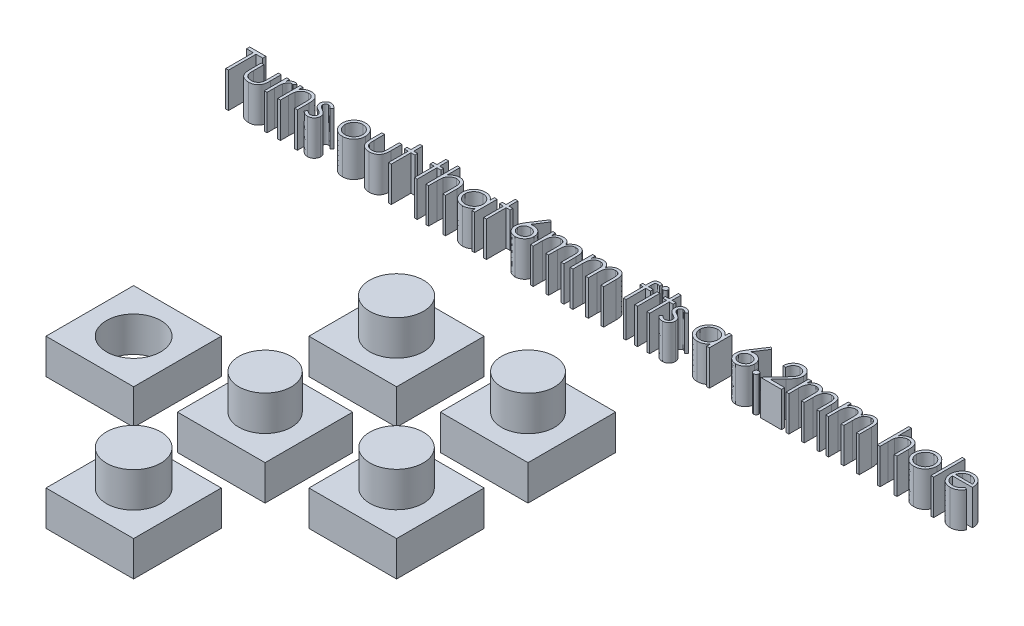
from build123d import *

# Parameters (mm, degrees)
SKETCH1_W              = 10
SKETCH1_H              = 10
SKETCH1_R              = 3
BOSS_EXTRUDE1_DEPTH    = 4
SKETCH1_R_2            = 3.1
BOSS_EXTRUDE1_2_DEPTH  = 4
SKETCH1_R_3            = 3.05
BOSS_EXTRUDE1_3_DEPTH  = 4
BOSS_EXTRUDE1_4_DEPTH  = 4
SKETCH1_R_4            = 3.075
BOSS_EXTRUDE1_5_DEPTH  = 4
SKETCH1_R_5            = 3.025
BOSS_EXTRUDE1_6_DEPTH  = 4
BOSS_EXTRUDE1_7_DEPTH  = 4
BOSS_EXTRUDE1_8_DEPTH  = 4
BOSS_EXTRUDE1_9_DEPTH  = 4
BOSS_EXTRUDE1_10_DEPTH = 4
BOSS_EXTRUDE1_11_DEPTH = 4
BOSS_EXTRUDE1_12_DEPTH = 4
BOSS_EXTRUDE1_13_DEPTH = 4
BOSS_EXTRUDE1_14_DEPTH = 4
BOSS_EXTRUDE1_15_DEPTH = 4
BOSS_EXTRUDE1_16_DEPTH = 4
BOSS_EXTRUDE1_17_DEPTH = 4
BOSS_EXTRUDE1_18_DEPTH = 4
BOSS_EXTRUDE1_19_DEPTH = 4
BOSS_EXTRUDE1_20_DEPTH = 4
BOSS_EXTRUDE1_21_DEPTH = 4
BOSS_EXTRUDE1_22_DEPTH = 4
BOSS_EXTRUDE1_23_DEPTH = 4
SKETCH1_W_2            = 0.314102564
SKETCH1_H_2            = 2.557692308
BOSS_EXTRUDE1_24_DEPTH = 4
BOSS_EXTRUDE1_25_DEPTH = 4
BOSS_EXTRUDE1_26_DEPTH = 4
BOSS_EXTRUDE1_27_DEPTH = 4
BOSS_EXTRUDE1_28_DEPTH = 4
BOSS_EXTRUDE1_29_DEPTH = 4
BOSS_EXTRUDE1_30_DEPTH = 4
BOSS_EXTRUDE1_31_DEPTH = 4
BOSS_EXTRUDE1_32_DEPTH = 4
BOSS_EXTRUDE1_33_DEPTH = 4
BOSS_EXTRUDE1_34_DEPTH = 4
SKETCH1_H_3            = 3.58974359
BOSS_EXTRUDE1_35_DEPTH = 4
BOSS_EXTRUDE1_36_DEPTH = 4
SKETCH1_3_R            = 3.075
SKETCH1_3_R_2          = 3.025
SKETCH1_3_R_3          = 3.05
SKETCH1_3_R_4          = 3
SKETCH1_3_R_5          = 3.1
BOSS_EXTRUDE2_DEPTH    = 8


with BuildPart() as part:
    # Sketch1 → Boss-Extrude1 (new body)
    with BuildSketch(Plane(origin=(0, 0, 0), x_dir=(1, 0, 0), z_dir=(0, 1, 0))):
        Rectangle(SKETCH1_W, SKETCH1_H)
        with Locations(Location((0, 0, 0), (0, 0, 270))):
            Circle(SKETCH1_R, mode=Mode.SUBTRACT)
    extrude(amount=BOSS_EXTRUDE1_DEPTH)



with BuildPart() as body_2:
    # Sketch1 → Boss-Extrude1 2 (new body)
    with BuildSketch(Plane(origin=(0, 0, 0), x_dir=(1, 0, 0), z_dir=(0, 1, 0))):
        with Locations((-15, 0)):
            Rectangle(SKETCH1_W, SKETCH1_H)
        with Locations(Location((-15, 0, 0), (0, 0, 270))):
            Circle(SKETCH1_R_2, mode=Mode.SUBTRACT)
    extrude(amount=BOSS_EXTRUDE1_2_DEPTH)


with BuildPart() as body_3:
    # Sketch1 → Boss-Extrude1 3 (new body)
    with BuildSketch(Plane(origin=(0, 0, 0), x_dir=(1, 0, 0), z_dir=(0, 1, 0))):
        with Locations((15, 0)):
            Rectangle(SKETCH1_W, SKETCH1_H)
        with Locations(Location((15, 0, 0), (0, 0, 270))):
            Circle(SKETCH1_R_3, mode=Mode.SUBTRACT)
    extrude(amount=BOSS_EXTRUDE1_3_DEPTH)


with BuildPart() as body_4:
    # Sketch1 → Boss-Extrude1 4 (new body)
    with BuildSketch(Plane(origin=(0, 0, 0), x_dir=(1, 0, 0), z_dir=(0, 1, 0))):
        with Locations((0, -15)):
            Rectangle(SKETCH1_W, SKETCH1_H)
        with Locations(Location((0, -15, 0), (0, 0, 270))):
            Circle(SKETCH1_R_2, mode=Mode.SUBTRACT)
    extrude(amount=BOSS_EXTRUDE1_4_DEPTH)


with BuildPart() as body_5:
    # Sketch1 → Boss-Extrude1 5 (new body)
    with BuildSketch(Plane(origin=(0, 0, 0), x_dir=(1, 0, 0), z_dir=(0, 1, 0))):
        with Locations((0, 15)):
            Rectangle(SKETCH1_W, SKETCH1_H)
        with Locations(Location((0, 15, 0), (0, 0, 270))):
            Circle(SKETCH1_R_4, mode=Mode.SUBTRACT)
    extrude(amount=BOSS_EXTRUDE1_5_DEPTH)


with BuildPart() as body_6:
    # Sketch1 → Boss-Extrude1 6 (new body)
    with BuildSketch(Plane(origin=(0, 0, 0), x_dir=(1, 0, 0), z_dir=(0, 1, 0))):
        with Locations((15, 15)):
            Rectangle(SKETCH1_W, SKETCH1_H)
        with Locations(Location((15, 15, 0), (0, 0, 270))):
            Circle(SKETCH1_R_5, mode=Mode.SUBTRACT)
    extrude(amount=BOSS_EXTRUDE1_6_DEPTH)


with BuildPart() as body_7:
    # Sketch1 → Boss-Extrude1 7 (new body)
    with BuildSketch(Plane(origin=(0, 0, 0), x_dir=(1, 0, 0), z_dir=(0, 1, 0))):
        Polygon((-36.957987545, 34.845119336), (-36.957987545, 35.204093695), (-35.118243956, 35.204093695), (-35.118243956, 34.845119336), (-35.881064468, 34.845119336), (-35.881064468, 31.704093695), (-36.195167032, 31.704093695), (-36.195167032, 34.845119336), align=None)
    extrude(amount=BOSS_EXTRUDE1_7_DEPTH)


with BuildPart() as body_8:
    # Sketch1 → Boss-Extrude1 8 (new body)
    with BuildSketch(Plane(origin=(0, 0, 0), x_dir=(1, 0, 0), z_dir=(0, 1, 0))):
        with BuildLine():
            Line((-34.714397802, 34.261786003), (-34.400295238, 34.261786003))
            Line((-34.400295238, 34.261786003), (-34.400295238, 33.075487926))
            add(Edge.make_bspline(
                [(-34.400295238, 33.075487926), (-34.400153333, 33.040665177), (-34.399881875, 32.974050889), (-34.398040934, 32.878195702), (-34.393710841, 32.79077899), (-34.388297016, 32.711750253), (-34.38133488, 32.641122861), (-34.37305152, 32.579143504), (-34.363793098, 32.52510932), (-34.354730384, 32.492565964), (-34.35051559, 32.477431035)],
                knots=[0, 0, 0, 0, 1.388932606, 2.656963016, 3.823490214, 4.879454478, 5.816252168, 6.653371382, 7.373723809, 8, 8, 8, 8], degree=3))
            add(Edge.make_bspline(
                [(-34.35051559, 32.477431035), (-34.343754135, 32.458408164), (-34.330371794, 32.420757903), (-34.30609831, 32.366368898), (-34.276069974, 32.315993615), (-34.243210146, 32.267689543), (-34.205310738, 32.222887556), (-34.162851267, 32.181663312), (-34.11725303, 32.142459221), (-34.049498007, 32.096074429), (-33.956838741, 32.046359099), (-33.835185986, 32.00346328), (-33.70328176, 31.97782746), (-33.61211704, 31.974853205), (-33.56525918, 31.973324465)],
                knots=[0, 0, 0, 0, 0.725840625, 1.436591201, 2.137033971, 2.831655856, 3.53531722, 4.242432219, 4.957935707, 5.694543706, 7.190802206, 8.724350549, 10.316345118, 12, 12, 12, 12], degree=3))
            add(Edge.make_bspline(
                [(-33.56525918, 31.973324465), (-33.518405672, 31.974885713), (-33.427752804, 31.97790644), (-33.297297835, 32.002689979), (-33.17804642, 32.044095668), (-33.071195469, 32.10190308), (-32.977229629, 32.172645143), (-32.89892521, 32.255653951), (-32.834317955, 32.348303338), (-32.806108535, 32.417427617), (-32.79192184, 32.452190651)],
                knots=[0, 0, 0, 0, 1.157059328, 2.238695713, 3.266970494, 4.264342957, 5.228770407, 6.160125903, 7.074715775, 8, 8, 8, 8], degree=3))
            add(Edge.make_bspline(
                [(-32.79192184, 32.452190651), (-32.78772761, 32.466156949), (-32.778455192, 32.497033025), (-32.76849284, 32.549412773), (-32.759518379, 32.611877378), (-32.751855203, 32.684835586), (-32.74639004, 32.768096739), (-32.743444013, 32.861634815), (-32.740115738, 32.965156175), (-32.740065222, 33.037623934), (-32.740038827, 33.075487926)],
                knots=[0, 0, 0, 0, 0.557542046, 1.232589297, 2.036731608, 2.971723315, 4.038036528, 5.22795436, 6.551621927, 8, 8, 8, 8], degree=3))
            Line((-32.740038827, 33.075487926), (-32.740038827, 34.261786003))
            Line((-32.740038827, 34.261786003), (-32.425936263, 34.261786003))
            Line((-32.425936263, 34.261786003), (-32.425936263, 33.016593695))
            add(Edge.make_bspline(
                [(-32.425936263, 33.016593695), (-32.426377958, 32.974286524), (-32.427234906, 32.892204824), (-32.43274225, 32.772920713), (-32.442191863, 32.661758468), (-32.456534548, 32.558659248), (-32.473400222, 32.463701766), (-32.495156495, 32.37676432), (-32.521134733, 32.298114766), (-32.550440248, 32.226372989), (-32.585062115, 32.161326095), (-32.621889136, 32.099590278), (-32.664413908, 32.042697343), (-32.709184142, 31.987815206), (-32.758985798, 31.937673679), (-32.812885657, 31.891122203), (-32.870125077, 31.847449171), (-32.931974275, 31.808357892), (-32.997530338, 31.773141246), (-33.066874195, 31.741925168), (-33.140855193, 31.717222591), (-33.21851883, 31.695911925), (-33.300245609, 31.679197456), (-33.385956742, 31.667410889), (-33.475623358, 31.660185559), (-33.536732818, 31.659548514), (-33.568063667, 31.659221901)],
                knots=[0, 0, 0, 0, 1.493040784, 2.896703357, 4.213163133, 5.428574705, 6.569057535, 7.615249723, 8.588095153, 9.490268104, 10.346124644, 11.18633936, 12.024365274, 12.850166724, 13.684164916, 14.514361689, 15.362232829, 16.222528818, 17.093394965, 17.986930858, 18.902426812, 19.842810585, 20.827885679, 21.843828298, 22.894529745, 24, 24, 24, 24], degree=3))
            add(Edge.make_bspline(
                [(-33.568063667, 31.659221901), (-33.599160181, 31.659561608), (-33.660267726, 31.660229164), (-33.749938971, 31.667370972), (-33.835887577, 31.679179142), (-33.917807975, 31.69603436), (-33.995782373, 31.717073429), (-34.070126613, 31.742076965), (-34.139970176, 31.773157447), (-34.20615218, 31.808135004), (-34.268154568, 31.84770028), (-34.326263146, 31.891068319), (-34.380399998, 31.938174382), (-34.430577066, 31.988821739), (-34.476090043, 32.043638676), (-34.517506085, 32.102184236), (-34.55546279, 32.163878325), (-34.58981558, 32.229941487), (-34.619327336, 32.302513497), (-34.645382582, 32.382810594), (-34.66669322, 32.471713111), (-34.684035688, 32.569145039), (-34.697987129, 32.674640081), (-34.707673271, 32.788808496), (-34.713089102, 32.911372188), (-34.713952163, 32.996022078), (-34.714397802, 33.039730715)],
                knots=[0, 0, 0, 0, 1.083640291, 2.129454052, 3.13281866, 4.105697902, 5.042300162, 5.946461698, 6.836384745, 7.703652036, 8.553297018, 9.397182691, 10.228592656, 11.052265423, 11.879314572, 12.708807002, 13.549817954, 14.402308542, 15.300838682, 16.27712199, 17.341985831, 18.484375296, 19.725102775, 21.0496083, 22.476576903, 24, 24, 24, 24], degree=3))
            Line((-34.714397802, 33.039730715), (-34.714397802, 34.261786003))
        make_face()
    extrude(amount=BOSS_EXTRUDE1_8_DEPTH)


with BuildPart() as body_9:
    # Sketch1 → Boss-Extrude1 9 (new body)
    with BuildSketch(Plane(origin=(0, 0, 0), x_dir=(1, 0, 0), z_dir=(0, 1, 0))):
        with BuildLine():
            Line((-31.797731135, 34.261786003), (-31.483628571, 34.261786003))
            Line((-31.483628571, 34.261786003), (-31.483628571, 33.885283599))
            add(Edge.make_bspline(
                [(-31.483628571, 33.885283599), (-31.460439812, 33.920339428), (-31.416091491, 33.987383427), (-31.342378562, 34.076052728), (-31.266875231, 34.149467774), (-31.189220043, 34.207971293), (-31.108841943, 34.251784412), (-31.027504992, 34.283877447), (-30.943929522, 34.302854762), (-30.887767598, 34.305388421), (-30.859630174, 34.306657798)],
                knots=[0, 0, 0, 0, 1.2804753, 2.448899062, 3.506932113, 4.484331642, 5.4025378, 6.288909075, 7.142734305, 8, 8, 8, 8], degree=3))
            add(Edge.make_bspline(
                [(-30.859630174, 34.306657798), (-30.837803847, 34.305467271), (-30.792894762, 34.303017686), (-30.724912172, 34.285806861), (-30.65486872, 34.258328838), (-30.609726333, 34.232488616), (-30.586192674, 34.219017574)],
                knots=[0, 0, 0, 0, 0.901110191, 1.854092781, 2.881294221, 4, 4, 4, 4], degree=3))
            Line((-30.586192674, 34.219017574), (-30.758668635, 33.946982317))
            add(Edge.make_bspline(
                [(-30.758668635, 33.946982317), (-30.773777656, 33.953722583), (-30.802457471, 33.966516899), (-30.844412037, 33.981658909), (-30.883093374, 33.990574825), (-30.907736932, 33.991925542), (-30.919225526, 33.992555234)],
                knots=[0, 0, 0, 0, 1.180555205, 2.24091978, 3.179933427, 4, 4, 4, 4], degree=3))
            add(Edge.make_bspline(
                [(-30.919225526, 33.992555234), (-30.94443126, 33.990875196), (-30.99584365, 33.987448407), (-31.071328149, 33.960509599), (-31.144575354, 33.916984359), (-31.202747017, 33.868713248), (-31.24778927, 33.82216545), (-31.279929495, 33.781517047), (-31.309412242, 33.735938416), (-31.337582463, 33.686208732), (-31.363248757, 33.631478886), (-31.387203426, 33.572295673), (-31.408862289, 33.508590544), (-31.421212533, 33.464208024), (-31.427538827, 33.441473503)],
                knots=[0, 0, 0, 0, 1.125678352, 2.296057538, 3.5422874, 4.923748041, 5.663163013, 6.437101912, 7.23742474, 8.08941207, 8.991984279, 9.93940061, 10.944477711, 12, 12, 12, 12], degree=3))
            add(Edge.make_bspline(
                [(-31.427538827, 33.441473503), (-31.432271221, 33.421196329), (-31.442753112, 33.376283931), (-31.45294465, 33.300935406), (-31.463014168, 33.211911747), (-31.470110787, 33.108965154), (-31.476688829, 32.992352711), (-31.480398911, 32.861896765), (-31.483502052, 32.717463414), (-31.483585118, 32.616489061), (-31.483628571, 32.563669016)],
                knots=[0, 0, 0, 0, 0.566838948, 1.255505196, 2.06880316, 3.007127437, 4.065329342, 5.249902469, 6.561414163, 8, 8, 8, 8], degree=3))
            Line((-31.483628571, 32.563669016), (-31.483628571, 31.704093695))
            Line((-31.483628571, 31.704093695), (-31.797731135, 31.704093695))
            Line((-31.797731135, 31.704093695), (-31.797731135, 34.261786003))
        make_face()
    extrude(amount=BOSS_EXTRUDE1_9_DEPTH)


with BuildPart() as body_10:
    # Sketch1 → Boss-Extrude1 10 (new body)
    with BuildSketch(Plane(origin=(0, 0, 0), x_dir=(1, 0, 0), z_dir=(0, 1, 0))):
        with BuildLine():
            Line((-30.272090109, 34.261786003), (-29.957987545, 34.261786003))
            Line((-29.957987545, 34.261786003), (-29.957987545, 33.800447862))
            add(Edge.make_bspline(
                [(-29.957987545, 33.800447862), (-29.92444991, 33.842290585), (-29.859368959, 33.923487848), (-29.750984626, 34.030208423), (-29.636440726, 34.118153648), (-29.516438722, 34.188257442), (-29.390815712, 34.241104068), (-29.260337442, 34.279269999), (-29.124222736, 34.302154828), (-29.031658299, 34.305145058), (-28.984830494, 34.306657798)],
                knots=[0, 0, 0, 0, 1.12780773, 2.188550248, 3.19190651, 4.159438251, 5.104880172, 6.052711206, 7.014878035, 8, 8, 8, 8], degree=3))
            add(Edge.make_bspline(
                [(-28.984830494, 34.306657798), (-28.93749986, 34.304912603), (-28.844862392, 34.301496834), (-28.709984331, 34.274480143), (-28.584010937, 34.228334888), (-28.467391381, 34.165122817), (-28.362264168, 34.086516344), (-28.269939316, 33.994938562), (-28.193576069, 33.889602479), (-28.142378706, 33.791879323), (-28.108653058, 33.705190529), (-28.087420721, 33.630943778), (-28.069389739, 33.548225627), (-28.053757991, 33.457286038), (-28.04318088, 33.357487848), (-28.034838588, 33.249240156), (-28.028859894, 33.132578025), (-28.028622687, 33.051891398), (-28.028500366, 33.010283599)],
                knots=[0, 0, 0, 0, 1.235846778, 2.418850247, 3.575807741, 4.728682307, 5.871620074, 6.994088408, 8.11269785, 9.256955736, 9.865816715, 10.540099792, 11.271859618, 12.076849838, 12.949306005, 13.892391288, 14.913166135, 16, 16, 16, 16], degree=3))
            Line((-28.028500366, 33.010283599), (-28.028500366, 31.704093695))
            Line((-28.028500366, 31.704093695), (-28.34260293, 31.704093695))
            Line((-28.34260293, 31.704093695), (-28.34260293, 32.907218695))
            add(Edge.make_bspline(
                [(-28.34260293, 32.907218695), (-28.342796138, 32.94204114), (-28.343165712, 33.008650551), (-28.344331359, 33.104019574), (-28.347141165, 33.190506153), (-28.351089478, 33.26790352), (-28.356868509, 33.336137357), (-28.36289114, 33.395346633), (-28.370256117, 33.445456176), (-28.37681903, 33.475621258), (-28.379762385, 33.489149785)],
                knots=[0, 0, 0, 0, 1.430800155, 2.736877192, 3.918605307, 4.986035426, 5.920637409, 6.731861385, 7.431261377, 8, 8, 8, 8], degree=3))
            add(Edge.make_bspline(
                [(-28.379762385, 33.489149785), (-28.390387917, 33.52886097), (-28.410838777, 33.605292715), (-28.46137276, 33.708967067), (-28.525186941, 33.797165255), (-28.603084791, 33.869341977), (-28.694313866, 33.925512813), (-28.798621009, 33.964486768), (-28.91499965, 33.988863037), (-28.996854032, 33.991290169), (-29.039517994, 33.992555234)],
                knots=[0, 0, 0, 0, 1.084156227, 2.086665306, 3.027808233, 3.945421172, 4.874247719, 5.839848303, 6.874090471, 8, 8, 8, 8], degree=3))
            add(Edge.make_bspline(
                [(-29.039517994, 33.992555234), (-29.064785678, 33.992079229), (-29.114789771, 33.991137228), (-29.188939743, 33.98168593), (-29.260863916, 33.966227475), (-29.331284125, 33.945358837), (-29.398791918, 33.916696568), (-29.46555621, 33.884167198), (-29.529062974, 33.843618986), (-29.590666371, 33.798428364), (-29.647979179, 33.748349157), (-29.701307517, 33.695504647), (-29.748845537, 33.639229043), (-29.791914212, 33.580429096), (-29.829092476, 33.518297258), (-29.861545564, 33.453432951), (-29.889081259, 33.385750802), (-29.902763951, 33.338775741), (-29.909610141, 33.31527158)],
                knots=[0, 0, 0, 0, 1.023777757, 2.026029729, 3.023749952, 4.003683103, 4.997618607, 5.993177895, 7.010360494, 8.046726602, 9.087585522, 10.09234134, 11.086953743, 12.070360549, 13.043493632, 14.017870808, 15.008233677, 16, 16, 16, 16], degree=3))
            add(Edge.make_bspline(
                [(-29.909610141, 33.31527158), (-29.91354979, 33.298016377), (-29.922126199, 33.260452703), (-29.931389379, 33.198808283), (-29.939796954, 33.127498308), (-29.946833913, 33.046605991), (-29.951139329, 32.955848116), (-29.955833726, 32.855612278), (-29.957542787, 32.74549879), (-29.957835141, 32.668837097), (-29.957987545, 32.628873343)],
                knots=[0, 0, 0, 0, 0.615963638, 1.340920617, 2.168419149, 3.115676021, 4.16674242, 5.331190069, 6.6087489, 8, 8, 8, 8], degree=3))
            Line((-29.957987545, 32.628873343), (-29.957987545, 31.704093695))
            Line((-29.957987545, 31.704093695), (-30.272090109, 31.704093695))
            Line((-30.272090109, 31.704093695), (-30.272090109, 34.261786003))
        make_face()
    extrude(amount=BOSS_EXTRUDE1_10_DEPTH)


with BuildPart() as body_11:
    # Sketch1 → Boss-Extrude1 11 (new body)
    with BuildSketch(Plane(origin=(0, 0, 0), x_dir=(1, 0, 0), z_dir=(0, 1, 0))):
        with BuildLine():
            Line((-26.099013186, 33.942775586), (-26.312154212, 33.723324465))
            add(Edge.make_bspline(
                [(-26.312154212, 33.723324465), (-26.330544716, 33.744637611), (-26.365999441, 33.785726848), (-26.422230922, 33.840663915), (-26.478254526, 33.886800853), (-26.533303339, 33.925753112), (-26.588761609, 33.955202259), (-26.643978527, 33.976697121), (-26.699011265, 33.989998927), (-26.7357973, 33.991713365), (-26.753860943, 33.992555234)],
                knots=[0, 0, 0, 0, 1.26578478, 2.440284043, 3.530471711, 4.527705817, 5.468200915, 6.346673037, 7.188140097, 8, 8, 8, 8], degree=3))
            add(Edge.make_bspline(
                [(-26.753860943, 33.992555234), (-26.776000333, 33.991480361), (-26.819567519, 33.989365163), (-26.881993337, 33.968251733), (-26.939943962, 33.935842994), (-26.990100942, 33.889874411), (-27.032588622, 33.837110142), (-27.063602303, 33.778113817), (-27.082568287, 33.714665773), (-27.084973019, 33.670635916), (-27.086192674, 33.648304433)],
                knots=[0, 0, 0, 0, 0.99966794, 1.967205029, 2.953328237, 3.988086729, 5.028030931, 6.008226631, 6.989793394, 8, 8, 8, 8], degree=3))
            add(Edge.make_bspline(
                [(-27.086192674, 33.648304433), (-27.085081861, 33.628092388), (-27.082863368, 33.587725278), (-27.065616689, 33.528177244), (-27.038150617, 33.470120206), (-27.012480422, 33.434557299), (-26.999253571, 33.416233118)],
                knots=[0, 0, 0, 0, 0.960159726, 1.917612774, 2.927026955, 4, 4, 4, 4], degree=3))
            add(Edge.make_bspline(
                [(-26.999253571, 33.416233118), (-26.991290077, 33.406448534), (-26.974340784, 33.38562328), (-26.942532269, 33.356719426), (-26.906509767, 33.324777175), (-26.863189829, 33.292840338), (-26.814438801, 33.259208613), (-26.759199517, 33.22520648), (-26.699225012, 33.188242055), (-26.656287705, 33.16479762), (-26.633969116, 33.152611324)],
                knots=[0, 0, 0, 0, 0.66740084, 1.420478572, 2.27185888, 3.217733974, 4.268547843, 5.408967954, 6.65319498, 8, 8, 8, 8], degree=3))
            add(Edge.make_bspline(
                [(-26.633969116, 33.152611324), (-26.606755539, 33.137366421), (-26.554187869, 33.107918288), (-26.479495101, 33.062208585), (-26.41170806, 33.016777161), (-26.350252393, 32.972109887), (-26.296310584, 32.926957019), (-26.248246031, 32.883049262), (-26.207257587, 32.839059954), (-26.184303661, 32.80832684), (-26.173332097, 32.793636965)],
                knots=[0, 0, 0, 0, 1.27191281, 2.456916733, 3.569705269, 4.599008579, 5.553216877, 6.436649441, 7.252746552, 8, 8, 8, 8], degree=3))
            add(Edge.make_bspline(
                [(-26.173332097, 32.793636965), (-26.155121569, 32.763970877), (-26.11887924, 32.704929855), (-26.080820973, 32.607711428), (-26.058760699, 32.504600926), (-26.055698478, 32.434068705), (-26.054141391, 32.398204272)],
                knots=[0, 0, 0, 0, 0.995354457, 1.980940102, 2.973342416, 4, 4, 4, 4], degree=3))
            add(Edge.make_bspline(
                [(-26.054141391, 32.398204272), (-26.054860925, 32.372935126), (-26.056278845, 32.323139513), (-26.066136912, 32.249804683), (-26.083091889, 32.179670126), (-26.106185642, 32.111974841), (-26.137370015, 32.048015901), (-26.173917813, 31.986179652), (-26.217792724, 31.927803722), (-26.2678841, 31.872964761), (-26.322729594, 31.822879014), (-26.381235732, 31.77885506), (-26.443474563, 31.742280723), (-26.509001364, 31.712015378), (-26.577965018, 31.68794712), (-26.650376308, 31.671284589), (-26.726005062, 31.661311827), (-26.77743487, 31.659927351), (-26.80364059, 31.659221901)],
                knots=[0, 0, 0, 0, 1.032770009, 2.035186124, 3.017557409, 3.978232242, 4.952395191, 5.920591857, 6.910227898, 7.931268572, 8.952309245, 9.941945286, 10.918353717, 11.897095711, 12.887975737, 13.898235213, 14.929059601, 16, 16, 16, 16], degree=3))
            add(Edge.make_bspline(
                [(-26.80364059, 31.659221901), (-26.839007766, 31.660214601), (-26.909250693, 31.662186208), (-27.013140412, 31.680692269), (-27.11466117, 31.709487663), (-27.213044711, 31.749203597), (-27.306090825, 31.79935431), (-27.391221749, 31.859416704), (-27.468733212, 31.927406701), (-27.512851485, 31.979519612), (-27.534910622, 32.005576067)],
                knots=[0, 0, 0, 0, 1.013940152, 2.01379169, 3.017749504, 4.037548394, 5.051665909, 6.043208538, 7.021604269, 8, 8, 8, 8], degree=3))
            Line((-27.534910622, 32.005576067), (-27.326677449, 32.242555234))
            add(Edge.make_bspline(
                [(-27.326677449, 32.242555234), (-27.306905036, 32.221200469), (-27.268573224, 32.179801029), (-27.207272007, 32.124676689), (-27.144892606, 32.078475418), (-27.08205792, 32.039832003), (-27.017837825, 32.0100566), (-26.952592211, 31.989138006), (-26.886453787, 31.975693813), (-26.842031651, 31.974115531), (-26.819766391, 31.973324465)],
                knots=[0, 0, 0, 0, 1.179806542, 2.287233372, 3.337373186, 4.324005949, 5.273901747, 6.200048787, 7.097828587, 8, 8, 8, 8], degree=3))
            add(Edge.make_bspline(
                [(-26.819766391, 31.973324465), (-26.789448466, 31.974695289), (-26.730212324, 31.977373651), (-26.645368565, 32.001690743), (-26.567029939, 32.039820695), (-26.499006593, 32.093905393), (-26.441104432, 32.156860966), (-26.399176258, 32.227775085), (-26.372900082, 32.304566542), (-26.369814084, 32.357798845), (-26.368243956, 32.384882958)],
                knots=[0, 0, 0, 0, 1.072336372, 2.095165389, 3.102688358, 4.141489647, 5.156069229, 6.117746104, 7.042326257, 8, 8, 8, 8], degree=3))
            add(Edge.make_bspline(
                [(-26.368243956, 32.384882958), (-26.36933025, 32.407192577), (-26.371474993, 32.451239933), (-26.388318265, 32.514990274), (-26.414931117, 32.575459554), (-26.441135765, 32.610849201), (-26.454481936, 32.628873343)],
                knots=[0, 0, 0, 0, 1.013901739, 2.00181326, 2.98231254, 4, 4, 4, 4], degree=3))
            add(Edge.make_bspline(
                [(-26.454481936, 32.628873343), (-26.462504331, 32.637908705), (-26.479980003, 32.657590987), (-26.512035244, 32.686016066), (-26.550417107, 32.716654165), (-26.59555727, 32.748985754), (-26.647546732, 32.782584359), (-26.706596207, 32.817273711), (-26.77189676, 32.854701437), (-26.818067391, 32.879521093), (-26.842202289, 32.892495138)],
                knots=[0, 0, 0, 0, 0.615000592, 1.339693406, 2.178160186, 3.116406724, 4.166410947, 5.330106347, 6.604359322, 8, 8, 8, 8], degree=3))
            add(Edge.make_bspline(
                [(-26.842202289, 32.892495138), (-26.868248929, 32.907034269), (-26.918761676, 32.935230286), (-26.990308967, 32.979146366), (-27.054856322, 33.023813641), (-27.113956896, 33.06672648), (-27.166117902, 33.110147424), (-27.21113385, 33.154124675), (-27.250777066, 33.196884661), (-27.272724478, 33.227181958), (-27.283207898, 33.241653792)],
                knots=[0, 0, 0, 0, 1.262093308, 2.447601706, 3.550203992, 4.582594899, 5.537233252, 6.418365656, 7.244515135, 8, 8, 8, 8], degree=3))
            add(Edge.make_bspline(
                [(-27.283207898, 33.241653792), (-27.301338498, 33.270799407), (-27.337606033, 33.329100822), (-27.372821224, 33.426411299), (-27.397027253, 33.528856356), (-27.399189643, 33.59954321), (-27.400295238, 33.63568424)],
                knots=[0, 0, 0, 0, 0.985009483, 1.970363186, 2.962279964, 4, 4, 4, 4], degree=3))
            add(Edge.make_bspline(
                [(-27.400295238, 33.63568424), (-27.399761042, 33.659309638), (-27.398715546, 33.705547889), (-27.390371495, 33.773486709), (-27.375179784, 33.838034863), (-27.356124861, 33.900161726), (-27.329641857, 33.95866382), (-27.297995951, 34.014321291), (-27.260808526, 34.067057209), (-27.217965236, 34.116060342), (-27.17085859, 34.160569668), (-27.119963821, 34.199368296), (-27.066425564, 34.232474651), (-27.010017145, 34.260239811), (-26.950196672, 34.281241194), (-26.887382285, 34.295698579), (-26.82170113, 34.305353782), (-26.776800004, 34.306216866), (-26.753860943, 34.306657798)],
                knots=[0, 0, 0, 0, 1.087655834, 2.128696564, 3.144119009, 4.137814668, 5.115653402, 6.093965665, 7.082169637, 8.081268856, 9.086088321, 10.061021666, 11.022561449, 11.980240094, 12.950172527, 13.934149372, 14.944599409, 16, 16, 16, 16], degree=3))
            add(Edge.make_bspline(
                [(-26.753860943, 34.306657798), (-26.726668879, 34.305553457), (-26.671774657, 34.30332406), (-26.589420031, 34.285618369), (-26.507186689, 34.256485265), (-26.424863339, 34.216249032), (-26.34305305, 34.164182156), (-26.261036193, 34.101252856), (-26.177828163, 34.027875142), (-26.12587185, 33.971775916), (-26.099013186, 33.942775586)],
                knots=[0, 0, 0, 0, 0.845714091, 1.707292901, 2.609013841, 3.555613372, 4.552488639, 5.621697636, 6.770543573, 8, 8, 8, 8], degree=3))
        make_face()
    extrude(amount=BOSS_EXTRUDE1_11_DEPTH)


with BuildPart() as body_12:
    # Sketch1 → Boss-Extrude1 12 (new body)
    with BuildSketch(Plane(origin=(0, 0, 0), x_dir=(1, 0, 0), z_dir=(0, 1, 0))):
        with BuildLine():
            add(Edge.make_bspline(
                [(-22.844405815, 34.306657798), (-22.796414542, 34.305635907), (-22.702315384, 34.303632228), (-22.564507498, 34.282217262), (-22.432962362, 34.249469898), (-22.30717617, 34.204198336), (-22.188759875, 34.143516385), (-22.075988631, 34.071107094), (-21.969171622, 33.985324501), (-21.905148592, 33.918966432), (-21.872651007, 33.885283599)],
                knots=[0, 0, 0, 0, 1.054011418, 2.066658804, 3.057071809, 4.030435133, 4.997543892, 5.974964718, 6.972108034, 8, 8, 8, 8], degree=3))
            add(Edge.make_bspline(
                [(-21.872651007, 33.885283599), (-21.844669053, 33.853069613), (-21.789246673, 33.789265071), (-21.718180954, 33.685809458), (-21.656959394, 33.578669358), (-21.607896433, 33.466422031), (-21.569211409, 33.35004736), (-21.541745713, 33.229145349), (-21.525408778, 33.103983002), (-21.523205811, 33.018979163), (-21.522090109, 32.975928631)],
                knots=[0, 0, 0, 0, 1.025258237, 2.030674902, 3.01204498, 3.988269485, 4.97094183, 5.956517959, 6.965070386, 8, 8, 8, 8], degree=3))
            add(Edge.make_bspline(
                [(-21.522090109, 32.975928631), (-21.523071447, 32.932628574), (-21.525010615, 32.84706564), (-21.543354231, 32.721046274), (-21.571885317, 32.598851452), (-21.612717155, 32.480992758), (-21.665075265, 32.367109931), (-21.728965952, 32.257700381), (-21.804837569, 32.152548248), (-21.890841566, 32.05254641), (-21.985893442, 31.960380195), (-22.089009591, 31.880051925), (-22.198163624, 31.811230401), (-22.314806978, 31.755793985), (-22.437874465, 31.712084285), (-22.567631533, 31.681384269), (-22.703876603, 31.662822585), (-22.796903824, 31.660439012), (-22.844405815, 31.659221901)],
                knots=[0, 0, 0, 0, 0.998656419, 1.973391657, 2.932242238, 3.890759089, 4.846373663, 5.82037756, 6.809684879, 7.83454468, 8.860553229, 9.859544525, 10.845671541, 11.83227036, 12.833544569, 13.85385346, 14.904124723, 16, 16, 16, 16], degree=3))
            add(Edge.make_bspline(
                [(-22.844405815, 31.659221901), (-22.892140534, 31.660443097), (-22.985631394, 31.662834871), (-23.122357376, 31.681312154), (-23.252346995, 31.712070137), (-23.375575593, 31.755937629), (-23.49272044, 31.811232173), (-23.602506937, 31.879843863), (-23.705706853, 31.960404018), (-23.800778837, 32.052539955), (-23.886777442, 32.152549911), (-23.962650451, 32.25769995), (-24.026540777, 32.367110043), (-24.078898981, 32.480992728), (-24.119730794, 32.59885146), (-24.148261886, 32.721046272), (-24.166605501, 32.847065641), (-24.168544669, 32.932628574), (-24.169526007, 32.975928631)],
                knots=[0, 0, 0, 0, 1.099876186, 2.154163076, 3.173186993, 4.173200201, 5.163417411, 6.152872554, 7.150605724, 8.17532212, 9.198891216, 10.186952605, 11.159729845, 12.11414092, 13.071450619, 14.029093627, 15.002601286, 16, 16, 16, 16], degree=3))
            add(Edge.make_bspline(
                [(-24.169526007, 32.975928631), (-24.168402697, 33.018745177), (-24.166178735, 33.10351458), (-24.149858226, 33.22844164), (-24.122499669, 33.349139029), (-24.083768273, 33.465064505), (-24.034253082, 33.576819941), (-23.973891794, 33.684224772), (-23.902101162, 33.787212573), (-23.84689921, 33.850934653), (-23.818965109, 33.883180234)],
                knots=[0, 0, 0, 0, 1.031353054, 2.041901799, 3.029428768, 4.008703097, 4.981709435, 5.96992636, 6.972712378, 8, 8, 8, 8], degree=3))
            add(Edge.make_bspline(
                [(-23.818965109, 33.883180234), (-23.786516518, 33.917155173), (-23.722700655, 33.983972869), (-23.615351927, 34.069505393), (-23.502858106, 34.143421467), (-23.38313318, 34.202897683), (-23.257450322, 34.2497362), (-23.125231079, 34.282301716), (-22.986955564, 34.303555071), (-22.892395943, 34.305613248), (-22.844405815, 34.306657798)],
                knots=[0, 0, 0, 0, 1.027980169, 2.021703884, 2.998553061, 3.971491411, 4.943284454, 5.930300938, 6.949603206, 8, 8, 8, 8], degree=3))
        make_face()
        with BuildLine():
            add(Edge.make_bspline(
                [(-22.845808058, 33.992555234), (-22.879745669, 33.991590642), (-22.946744798, 33.98968636), (-23.045364383, 33.975202455), (-23.140304537, 33.952254951), (-23.231745381, 33.919650895), (-23.319378553, 33.877551996), (-23.403287956, 33.825843635), (-23.483720396, 33.765210679), (-23.559102459, 33.695748007), (-23.628284771, 33.619869013), (-23.688762748, 33.539020654), (-23.740187854, 33.454514308), (-23.783028013, 33.366262097), (-23.814935201, 33.273369683), (-23.838108224, 33.176889051), (-23.852578464, 33.076623635), (-23.854464843, 33.008462617), (-23.855423443, 32.973825266)],
                knots=[0, 0, 0, 0, 1.021534396, 2.016698045, 2.994645724, 3.958388632, 4.93408049, 5.916473867, 6.921342795, 7.962252576, 8.998418191, 10.008913653, 10.997312074, 11.973003931, 12.956656626, 13.948281152, 14.957379055, 16, 16, 16, 16], degree=3))
            add(Edge.make_bspline(
                [(-23.855423443, 32.973825266), (-23.853816619, 32.929073239), (-23.850627375, 32.840248833), (-23.824692138, 32.709437711), (-23.781305858, 32.583855858), (-23.722718579, 32.464239472), (-23.64931236, 32.353567194), (-23.562825293, 32.25489571), (-23.464185593, 32.169709899), (-23.354569093, 32.099029053), (-23.236214775, 32.042869297), (-23.110958454, 32.003070322), (-22.98031776, 31.977198629), (-22.891037029, 31.974627155), (-22.845808058, 31.973324465)],
                knots=[0, 0, 0, 0, 1.016792936, 2.018143844, 3.017858371, 4.030088057, 5.03801393, 6.028138512, 7.003788237, 7.991172063, 8.984598303, 9.972568034, 10.972917682, 12, 12, 12, 12], degree=3))
            add(Edge.make_bspline(
                [(-22.845808058, 31.973324465), (-22.800581689, 31.974634745), (-22.711306093, 31.977221202), (-22.580846916, 32.002940021), (-22.455932945, 32.043043682), (-22.337701557, 32.098965892), (-22.228134954, 32.169978307), (-22.128785832, 32.254414684), (-22.043037221, 32.353828535), (-21.969703616, 32.464386064), (-21.910156874, 32.583670416), (-21.866973672, 32.709460888), (-21.840976086, 32.84024293), (-21.837795257, 32.929071261), (-21.836192674, 32.973825266)],
                knots=[0, 0, 0, 0, 1.02726834, 2.027799167, 3.010890988, 4.004497153, 4.992059811, 5.971914811, 6.958719428, 7.966827853, 8.981595046, 9.981490638, 10.983022906, 12, 12, 12, 12], degree=3))
            add(Edge.make_bspline(
                [(-21.836192674, 32.973825266), (-21.837150944, 33.008462824), (-21.839036673, 33.076624249), (-21.853511637, 33.176886703), (-21.876667177, 33.273378299), (-21.908638794, 33.366230303), (-21.951292808, 33.454742807), (-22.003709601, 33.538772534), (-22.063940626, 33.62014908), (-22.133957747, 33.695502721), (-22.209261125, 33.765237758), (-22.289726163, 33.825867147), (-22.373511142, 33.877324742), (-22.460889725, 33.920010983), (-22.552342292, 33.951958323), (-22.647149421, 33.975334955), (-22.745348231, 33.989625151), (-22.812107274, 33.991572293), (-22.845808058, 33.992555234)],
                knots=[0, 0, 0, 0, 1.042956736, 2.052379634, 3.044323526, 4.02829302, 5.004299113, 5.996692471, 7.007513377, 8.048758398, 9.090003419, 10.095195979, 11.07790575, 12.047570684, 13.018257071, 13.989683339, 14.985167495, 16, 16, 16, 16], degree=3))
        make_face(mode=Mode.SUBTRACT)
    extrude(amount=BOSS_EXTRUDE1_12_DEPTH)


with BuildPart() as body_13:
    # Sketch1 → Boss-Extrude1 13 (new body)
    with BuildSketch(Plane(origin=(0, 0, 0), x_dir=(1, 0, 0), z_dir=(0, 1, 0))):
        with BuildLine():
            Line((-20.938756776, 34.261786003), (-20.624654212, 34.261786003))
            Line((-20.624654212, 34.261786003), (-20.624654212, 33.075487926))
            add(Edge.make_bspline(
                [(-20.624654212, 33.075487926), (-20.624512307, 33.040665177), (-20.62424085, 32.974050889), (-20.622399909, 32.878195702), (-20.618069815, 32.79077899), (-20.612655991, 32.711750253), (-20.605693854, 32.641122861), (-20.597410494, 32.579143504), (-20.588152072, 32.52510932), (-20.579089358, 32.492565964), (-20.574874565, 32.477431035)],
                knots=[0, 0, 0, 0, 1.388932606, 2.656963016, 3.823490214, 4.879454478, 5.816252168, 6.653371382, 7.373723809, 8, 8, 8, 8], degree=3))
            add(Edge.make_bspline(
                [(-20.574874565, 32.477431035), (-20.56811311, 32.458408164), (-20.554730769, 32.420757903), (-20.530457285, 32.366368898), (-20.500428948, 32.315993615), (-20.46756912, 32.267689543), (-20.429669713, 32.222887556), (-20.387210242, 32.181663312), (-20.341612005, 32.142459221), (-20.273856981, 32.096074429), (-20.181197715, 32.046359099), (-20.05954496, 32.00346328), (-19.927640734, 31.97782746), (-19.836476015, 31.974853205), (-19.789618154, 31.973324465)],
                knots=[0, 0, 0, 0, 0.725840625, 1.436591201, 2.137033971, 2.831655856, 3.53531722, 4.242432219, 4.957935707, 5.694543706, 7.190802206, 8.724350549, 10.316345118, 12, 12, 12, 12], degree=3))
            add(Edge.make_bspline(
                [(-19.789618154, 31.973324465), (-19.742764647, 31.974885713), (-19.652111778, 31.97790644), (-19.521656809, 32.002689979), (-19.402405395, 32.044095668), (-19.295554443, 32.10190308), (-19.201588603, 32.172645143), (-19.123284184, 32.255653951), (-19.05867693, 32.348303338), (-19.030467509, 32.417427617), (-19.016280815, 32.452190651)],
                knots=[0, 0, 0, 0, 1.157059328, 2.238695713, 3.266970494, 4.264342957, 5.228770407, 6.160125903, 7.074715775, 8, 8, 8, 8], degree=3))
            add(Edge.make_bspline(
                [(-19.016280815, 32.452190651), (-19.012086584, 32.466156949), (-19.002814166, 32.497033025), (-18.992851815, 32.549412773), (-18.983877353, 32.611877378), (-18.976214177, 32.684835586), (-18.970749014, 32.768096739), (-18.967802988, 32.861634815), (-18.964474712, 32.965156175), (-18.964424196, 33.037623934), (-18.964397802, 33.075487926)],
                knots=[0, 0, 0, 0, 0.557542046, 1.232589297, 2.036731608, 2.971723315, 4.038036528, 5.22795436, 6.551621927, 8, 8, 8, 8], degree=3))
            Line((-18.964397802, 33.075487926), (-18.964397802, 34.261786003))
            Line((-18.964397802, 34.261786003), (-18.650295238, 34.261786003))
            Line((-18.650295238, 34.261786003), (-18.650295238, 33.016593695))
            add(Edge.make_bspline(
                [(-18.650295238, 33.016593695), (-18.650736932, 32.974286524), (-18.651593881, 32.892204824), (-18.657101224, 32.772920713), (-18.666550837, 32.661758468), (-18.680893522, 32.558659248), (-18.697759197, 32.463701766), (-18.719515469, 32.37676432), (-18.745493707, 32.298114766), (-18.774799222, 32.226372989), (-18.80942109, 32.161326095), (-18.84624811, 32.099590278), (-18.888772882, 32.042697343), (-18.933543116, 31.987815206), (-18.983344772, 31.937673679), (-19.037244631, 31.891122203), (-19.094484051, 31.847449171), (-19.156333249, 31.808357892), (-19.221889312, 31.773141246), (-19.291233169, 31.741925168), (-19.365214167, 31.717222591), (-19.442877804, 31.695911925), (-19.524604583, 31.679197456), (-19.610315717, 31.667410889), (-19.699982333, 31.660185559), (-19.761091793, 31.659548514), (-19.792422641, 31.659221901)],
                knots=[0, 0, 0, 0, 1.493040784, 2.896703357, 4.213163133, 5.428574705, 6.569057535, 7.615249723, 8.588095153, 9.490268104, 10.346124644, 11.18633936, 12.024365274, 12.850166724, 13.684164916, 14.514361689, 15.362232829, 16.222528818, 17.093394965, 17.986930858, 18.902426812, 19.842810585, 20.827885679, 21.843828298, 22.894529745, 24, 24, 24, 24], degree=3))
            add(Edge.make_bspline(
                [(-19.792422641, 31.659221901), (-19.823519156, 31.659561608), (-19.884626701, 31.660229164), (-19.974297945, 31.667370972), (-20.060246551, 31.679179142), (-20.14216695, 31.69603436), (-20.220141347, 31.717073429), (-20.294485587, 31.742076965), (-20.36432915, 31.773157447), (-20.430511154, 31.808135004), (-20.492513542, 31.84770028), (-20.55062212, 31.891068319), (-20.604758973, 31.938174382), (-20.654936041, 31.988821739), (-20.700449017, 32.043638676), (-20.741865059, 32.102184236), (-20.779821764, 32.163878325), (-20.814174555, 32.229941487), (-20.84368631, 32.302513497), (-20.869741556, 32.382810594), (-20.891052194, 32.471713111), (-20.908394663, 32.569145039), (-20.922346103, 32.674640081), (-20.932032246, 32.788808496), (-20.937448076, 32.911372188), (-20.938311138, 32.996022078), (-20.938756776, 33.039730715)],
                knots=[0, 0, 0, 0, 1.083640291, 2.129454052, 3.13281866, 4.105697902, 5.042300162, 5.946461698, 6.836384745, 7.703652036, 8.553297018, 9.397182691, 10.228592656, 11.052265423, 11.879314572, 12.708807002, 13.549817954, 14.402308542, 15.300838682, 16.27712199, 17.341985831, 18.484375296, 19.725102775, 21.0496083, 22.476576903, 24, 24, 24, 24], degree=3))
            Line((-20.938756776, 33.039730715), (-20.938756776, 34.261786003))
        make_face()
    extrude(amount=BOSS_EXTRUDE1_13_DEPTH)


with BuildPart() as body_14:
    # Sketch1 → Boss-Extrude1 14 (new body)
    with BuildSketch(Plane(origin=(0, 0, 0), x_dir=(1, 0, 0), z_dir=(0, 1, 0))):
        Polygon((-17.618243956, 35.293837285), (-17.304141391, 35.293837285), (-17.304141391, 34.261786003), (-16.855423443, 34.261786003), (-16.855423443, 33.947683439), (-17.304141391, 33.947683439), (-17.304141391, 31.704093695), (-17.618243956, 31.704093695), (-17.618243956, 33.947683439), (-18.066961904, 33.947683439), (-18.066961904, 34.261786003), (-17.618243956, 34.261786003), align=None)
    extrude(amount=BOSS_EXTRUDE1_14_DEPTH)


with BuildPart() as body_15:
    # Sketch1 → Boss-Extrude1 15 (new body)
    with BuildSketch(Plane(origin=(0, 0, 0), x_dir=(1, 0, 0), z_dir=(0, 1, 0))):
        Polygon((-14.656705494, 35.293837285), (-14.34260293, 35.293837285), (-14.34260293, 34.261786003), (-13.893884981, 34.261786003), (-13.893884981, 33.947683439), (-14.34260293, 33.947683439), (-14.34260293, 31.704093695), (-14.656705494, 31.704093695), (-14.656705494, 33.947683439), (-15.105423443, 33.947683439), (-15.105423443, 34.261786003), (-14.656705494, 34.261786003), align=None)
    extrude(amount=BOSS_EXTRUDE1_15_DEPTH)


with BuildPart() as body_16:
    # Sketch1 → Boss-Extrude1 16 (new body)
    with BuildSketch(Plane(origin=(0, 0, 0), x_dir=(1, 0, 0), z_dir=(0, 1, 0))):
        with BuildLine():
            Line((-13.355423443, 35.293837285), (-13.041320879, 35.293837285))
            Line((-13.041320879, 35.293837285), (-13.041320879, 33.778713086))
            add(Edge.make_bspline(
                [(-13.041320879, 33.778713086), (-13.007603577, 33.820857068), (-12.941954263, 33.902913561), (-12.831458146, 34.009974752), (-12.717987274, 34.102773373), (-12.597622464, 34.17664383), (-12.472571944, 34.235000374), (-12.3423083, 34.27638802), (-12.206807328, 34.301839117), (-12.114782178, 34.305037535), (-12.068163827, 34.306657798)],
                knots=[0, 0, 0, 0, 1.125788106, 2.19196713, 3.20547328, 4.180437432, 5.132270164, 6.079753143, 7.027236121, 8, 8, 8, 8], degree=3))
            add(Edge.make_bspline(
                [(-12.068163827, 34.306657798), (-12.020833435, 34.304912368), (-11.928196439, 34.30149614), (-11.793314976, 34.274482759), (-11.667354101, 34.228325321), (-11.550688259, 34.165158295), (-11.445863562, 34.086485468), (-11.353013797, 33.995653946), (-11.277172999, 33.890380027), (-11.225573882, 33.793123773), (-11.192000474, 33.70658502), (-11.170748647, 33.632348507), (-11.152729449, 33.549626594), (-11.137029713, 33.458461862), (-11.126566132, 33.35841669), (-11.118161514, 33.249942436), (-11.112185059, 33.133045318), (-11.111953455, 33.052125068), (-11.111833699, 33.010283599)],
                knots=[0, 0, 0, 0, 1.235656852, 2.418478516, 3.575258207, 4.727955599, 5.870717718, 6.98870536, 8.107142894, 9.245821548, 9.854588956, 10.528768408, 11.260415777, 12.065282286, 12.943670737, 13.886611085, 14.907229059, 16, 16, 16, 16], degree=3))
            Line((-11.111833699, 33.010283599), (-11.111833699, 31.704093695))
            Line((-11.111833699, 31.704093695), (-11.425936263, 31.704093695))
            Line((-11.425936263, 31.704093695), (-11.425936263, 32.907218695))
            add(Edge.make_bspline(
                [(-11.425936263, 32.907218695), (-11.426126566, 32.942041365), (-11.426490584, 33.008651205), (-11.427693929, 33.104017314), (-11.430380144, 33.190513448), (-11.43472097, 33.2678624), (-11.439286277, 33.336172003), (-11.445569594, 33.395343058), (-11.452879828, 33.445456833), (-11.45944861, 33.475621462), (-11.462394597, 33.489149785)],
                knots=[0, 0, 0, 0, 1.430932559, 2.737130458, 3.918967929, 4.986496826, 5.920444988, 6.731744033, 7.431208747, 8, 8, 8, 8], degree=3))
            add(Edge.make_bspline(
                [(-11.462394597, 33.489149785), (-11.473818842, 33.528844049), (-11.495781886, 33.605156039), (-11.546829864, 33.70881845), (-11.610588875, 33.79720319), (-11.688436136, 33.869117478), (-11.7789945, 33.925529018), (-11.882854464, 33.9645968), (-11.999038533, 33.988844522), (-12.080890005, 33.991283825), (-12.123552449, 33.992555234)],
                knots=[0, 0, 0, 0, 1.090059168, 2.095632401, 3.037101401, 3.955032261, 4.878929692, 5.839099886, 6.873700383, 8, 8, 8, 8], degree=3))
            add(Edge.make_bspline(
                [(-12.123552449, 33.992555234), (-12.148820222, 33.992079408), (-12.198824493, 33.99113776), (-12.272973158, 33.981683861), (-12.344902222, 33.966235142), (-12.4153044, 33.945330604), (-12.482687598, 33.916885067), (-12.549015922, 33.883954878), (-12.612410131, 33.843646623), (-12.673995948, 33.798420855), (-12.731313482, 33.748351096), (-12.784640597, 33.695504141), (-12.832178937, 33.639229177), (-12.875247528, 33.58042906), (-12.912425814, 33.518297267), (-12.944878896, 33.453432949), (-12.972414592, 33.385750803), (-12.986097285, 33.338775741), (-12.992943475, 33.31527158)],
                knots=[0, 0, 0, 0, 1.024319606, 2.027102035, 3.025350316, 4.005802111, 5.00026367, 5.987881639, 7.005602596, 8.042517216, 9.083927026, 10.089214625, 11.084353441, 12.06828073, 13.041928858, 14.016821737, 15.00770877, 16, 16, 16, 16], degree=3))
            add(Edge.make_bspline(
                [(-12.992943475, 33.31527158), (-12.996882902, 33.298250629), (-13.005467399, 33.261159882), (-13.014782232, 33.199985558), (-13.023120029, 33.128899186), (-13.030168579, 33.048008586), (-13.034491665, 32.957017344), (-13.039149906, 32.856546384), (-13.04088392, 32.745966364), (-13.041170873, 32.669070856), (-13.041320879, 32.628873343)],
                knots=[0, 0, 0, 0, 0.607992626, 1.324890765, 2.152360218, 3.099583803, 4.150613268, 5.323148443, 6.60066238, 8, 8, 8, 8], degree=3))
            Line((-13.041320879, 32.628873343), (-13.041320879, 31.704093695))
            Line((-13.041320879, 31.704093695), (-13.355423443, 31.704093695))
            Line((-13.355423443, 31.704093695), (-13.355423443, 35.293837285))
        make_face()
    extrude(amount=BOSS_EXTRUDE1_16_DEPTH)


with BuildPart() as body_17:
    # Sketch1 → Boss-Extrude1 17 (new body)
    with BuildSketch(Plane(origin=(0, 0, 0), x_dir=(1, 0, 0), z_dir=(0, 1, 0))):
        with BuildLine():
            Line((-7.791320879, 34.261786003), (-7.791320879, 31.704093695))
            Line((-7.791320879, 31.704093695), (-8.105423443, 31.704093695))
            Line((-8.105423443, 31.704093695), (-8.105423443, 32.146501548))
            add(Edge.make_bspline(
                [(-8.105423443, 32.146501548), (-8.140842233, 32.106461954), (-8.209962449, 32.028324183), (-8.325403567, 31.92624201), (-8.447771745, 31.841863689), (-8.576473066, 31.773713773), (-8.711391309, 31.722521717), (-8.852227396, 31.686135558), (-8.999038777, 31.662741723), (-9.099291132, 31.660405701), (-9.150094917, 31.659221901)],
                knots=[0, 0, 0, 0, 1.074387032, 2.096679803, 3.090159297, 4.057316773, 5.018401886, 5.985159533, 6.978961417, 8, 8, 8, 8], degree=3))
            add(Edge.make_bspline(
                [(-9.150094917, 31.659221901), (-9.195262871, 31.660448273), (-9.284336076, 31.662866733), (-9.415365153, 31.681629037), (-9.541457402, 31.711759658), (-9.662731975, 31.753660548), (-9.778404121, 31.80924137), (-9.889464217, 31.875782618), (-9.995336909, 31.955023448), (-10.094408448, 32.045611476), (-10.185640449, 32.144006463), (-10.265701721, 32.24895201), (-10.332454801, 32.359994314), (-10.388274882, 32.475727468), (-10.431271226, 32.597042387), (-10.46124486, 32.723519555), (-10.479985307, 32.855009429), (-10.482402768, 32.944548952), (-10.483628571, 32.989951067)],
                knots=[0, 0, 0, 0, 1.033919861, 2.038935746, 3.024066025, 3.998881131, 4.97069526, 5.957263378, 6.95902576, 7.993208707, 9.027059324, 10.027763471, 11.009749337, 11.988697705, 12.965288445, 13.950418724, 14.960734635, 16, 16, 16, 16], degree=3))
            add(Edge.make_bspline(
                [(-10.483628571, 32.989951067), (-10.4823756, 33.034414771), (-10.479898543, 33.122317114), (-10.461445323, 33.251595812), (-10.430414314, 33.376114073), (-10.386866467, 33.495471016), (-10.331024512, 33.609811066), (-10.263096425, 33.719215091), (-10.1830773, 33.823984489), (-10.090824893, 33.921655715), (-9.990890123, 34.01187633), (-9.883981392, 34.090285375), (-9.77275811, 34.158002224), (-9.6554951, 34.2116557), (-9.533927995, 34.255064805), (-9.406974549, 34.285097773), (-9.275162971, 34.302795094), (-9.185672479, 34.305357858), (-9.140279212, 34.306657798)],
                knots=[0, 0, 0, 0, 1.020392517, 2.01726096, 2.990465484, 3.961182959, 4.928053699, 5.906110375, 6.912531644, 7.948652711, 8.985773172, 9.998621852, 10.987621588, 11.969261332, 12.953316658, 13.946091881, 14.958173133, 16, 16, 16, 16], degree=3))
            add(Edge.make_bspline(
                [(-9.140279212, 34.306657798), (-9.088079353, 34.305220046), (-8.985717893, 34.302400683), (-8.835989884, 34.278937956), (-8.694345406, 34.239299489), (-8.559691054, 34.185381991), (-8.432510368, 34.113733262), (-8.314007383, 34.023353301), (-8.2029419, 33.914812114), (-8.138561608, 33.831441669), (-8.105423443, 33.788528792)],
                knots=[0, 0, 0, 0, 1.038897134, 2.037228247, 3.008116434, 3.962042015, 4.918381754, 5.904844433, 6.921570401, 8, 8, 8, 8], degree=3))
            Line((-8.105423443, 33.788528792), (-8.105423443, 34.261786003))
            Line((-8.105423443, 34.261786003), (-7.791320879, 34.261786003))
        make_face()
        with BuildLine():
            add(Edge.make_bspline(
                [(-9.136072481, 33.992555234), (-9.181986819, 33.990921596), (-9.272614419, 33.987697055), (-9.405658421, 33.96252356), (-9.532971835, 33.920638966), (-9.653917909, 33.863357064), (-9.766586126, 33.791328328), (-9.867279797, 33.704206944), (-9.956822498, 33.60436993), (-10.032130763, 33.49226782), (-10.093521259, 33.372089729), (-10.136688291, 33.246465291), (-10.165157539, 33.117660313), (-10.168066059, 33.030297627), (-10.169526007, 32.986445458)],
                knots=[0, 0, 0, 0, 1.031046209, 2.035121221, 3.029706178, 4.034933723, 5.034054252, 6.02443088, 7.017295772, 8.038157696, 9.050218397, 10.03989886, 11.016116709, 12, 12, 12, 12], degree=3))
            add(Edge.make_bspline(
                [(-10.169526007, 32.986445458), (-10.167661114, 32.942855351), (-10.163938637, 32.855845995), (-10.137187942, 32.726865418), (-10.092308069, 32.601211376), (-10.031066006, 32.479950383), (-9.954379381, 32.367366282), (-9.865490729, 32.26562616), (-9.763540448, 32.178136572), (-9.65061294, 32.104898998), (-9.53000497, 32.045736477), (-9.403171039, 32.004570838), (-9.2724954, 31.977993057), (-9.183643067, 31.97488858), (-9.138876968, 31.973324465)],
                knots=[0, 0, 0, 0, 0.979072187, 1.954306742, 2.945804271, 3.96968567, 4.997920485, 5.998718438, 6.996577872, 8.005894225, 9.015743152, 10.005417472, 10.995077863, 12, 12, 12, 12], degree=3))
            add(Edge.make_bspline(
                [(-9.138876968, 31.973324465), (-9.093430466, 31.974984429), (-9.003041879, 31.978285932), (-8.869603171, 32.003567197), (-8.740108208, 32.045335996), (-8.61632098, 32.103235123), (-8.501004849, 32.174992478), (-8.397506971, 32.258999569), (-8.309991003, 32.356702754), (-8.235798393, 32.464079207), (-8.177622977, 32.581791203), (-8.135246917, 32.707125394), (-8.110193012, 32.840086142), (-8.107035282, 32.930950069), (-8.105423443, 32.977330875)],
                knots=[0, 0, 0, 0, 1.01762866, 2.023962475, 3.030623092, 4.058876274, 5.077231937, 6.066672613, 7.034107872, 8.005628644, 8.981990164, 9.965428785, 10.961468474, 12, 12, 12, 12], degree=3))
            add(Edge.make_bspline(
                [(-8.105423443, 32.977330875), (-8.106383099, 33.012668705), (-8.108272007, 33.082224739), (-8.122702576, 33.184352256), (-8.145657502, 33.282085982), (-8.178003673, 33.375528671), (-8.220494957, 33.464163687), (-8.271742723, 33.548627447), (-8.332648173, 33.628480658), (-8.402230869, 33.702623729), (-8.478396071, 33.770250192), (-8.558990612, 33.830614432), (-8.644969359, 33.880203205), (-8.734886396, 33.921244477), (-8.82889773, 33.953903626), (-8.92776835, 33.97569132), (-9.030447337, 33.990651641), (-9.100493392, 33.991914022), (-9.136072481, 33.992555234)],
                knots=[0, 0, 0, 0, 1.050140795, 2.067009409, 3.05949893, 4.030605086, 5.00011959, 5.97591094, 6.962425594, 7.979863591, 8.993523472, 9.986985069, 10.967611495, 11.937549037, 12.921786183, 13.919465291, 14.943216303, 16, 16, 16, 16], degree=3))
        make_face(mode=Mode.SUBTRACT)
    extrude(amount=BOSS_EXTRUDE1_17_DEPTH)


with BuildPart() as body_18:
    # Sketch1 → Boss-Extrude1 18 (new body)
    with BuildSketch(Plane(origin=(0, 0, 0), x_dir=(1, 0, 0), z_dir=(0, 1, 0))):
        Polygon((-6.759269597, 35.293837285), (-6.445167032, 35.293837285), (-6.445167032, 34.261786003), (-5.996449084, 34.261786003), (-5.996449084, 33.947683439), (-6.445167032, 33.947683439), (-6.445167032, 31.704093695), (-6.759269597, 31.704093695), (-6.759269597, 33.947683439), (-7.207987545, 33.947683439), (-7.207987545, 34.261786003), (-6.759269597, 34.261786003), align=None)
    extrude(amount=BOSS_EXTRUDE1_18_DEPTH)


with BuildPart() as body_19:
    # Sketch1 → Boss-Extrude1 19 (new body)
    with BuildSketch(Plane(origin=(0, 0, 0), x_dir=(1, 0, 0), z_dir=(0, 1, 0))):
        with BuildLine():
            Line((-2.720808058, 35.293837285), (-2.478921039, 35.103833279))
            Line((-2.478921039, 35.103833279), (-3.403700686, 33.689670618))
            add(Edge.make_bspline(
                [(-3.403700686, 33.689670618), (-3.342130409, 33.699484479), (-3.222030623, 33.718627524), (-3.100464724, 33.721785469), (-3.041220718, 33.723324465)],
                knots=[0, 0, 0, 0, 1.025318673, 2, 2, 2, 2], degree=3))
            add(Edge.make_bspline(
                [(-3.041220718, 33.723324465), (-3.005648222, 33.722368353), (-2.935624822, 33.720486275), (-2.832818019, 33.706002425), (-2.734029083, 33.683177313), (-2.639667471, 33.649905057), (-2.549394489, 33.607402703), (-2.462692093, 33.556463832), (-2.381190083, 33.494458152), (-2.303838904, 33.425193196), (-2.233611807, 33.348476212), (-2.171435751, 33.267074875), (-2.119208959, 33.181073994), (-2.076835038, 33.090517128), (-2.043930159, 32.995543868), (-2.019942514, 32.896275729), (-2.005762921, 32.792644258), (-2.00383743, 32.722166082), (-2.00285934, 32.68636533)],
                knots=[0, 0, 0, 0, 1.04369286, 2.054478336, 3.041073146, 4.015093852, 4.984733326, 5.965804835, 6.960378782, 7.985147595, 9.009457201, 10.008161701, 10.986880575, 11.956520048, 12.937015923, 13.931873656, 14.949455224, 16, 16, 16, 16], degree=3))
            add(Edge.make_bspline(
                [(-2.00285934, 32.68636533), (-2.004282445, 32.637385626), (-2.007082779, 32.54100516), (-2.034986575, 32.400628454), (-2.078346219, 32.266895938), (-2.140323748, 32.141942767), (-2.217306131, 32.025940197), (-2.311183724, 31.923154732), (-2.418627212, 31.831484694), (-2.54011401, 31.754828075), (-2.670856974, 31.692225024), (-2.808208972, 31.647259782), (-2.950836118, 31.619576313), (-3.047640726, 31.61610571), (-3.09660934, 31.614350106)],
                knots=[0, 0, 0, 0, 1.031375318, 2.029502543, 3.004789286, 3.987476834, 4.960371455, 5.9300674, 6.912260825, 7.929083631, 8.949397511, 9.960523116, 10.96833055, 12, 12, 12, 12], degree=3))
            add(Edge.make_bspline(
                [(-3.09660934, 31.614350106), (-3.143706041, 31.615878311), (-3.236996359, 31.618905419), (-3.374229153, 31.645871357), (-3.50609217, 31.68957846), (-3.631661551, 31.749792739), (-3.747982164, 31.825850622), (-3.852047801, 31.917412901), (-3.943339575, 32.022522366), (-4.019314196, 32.141162713), (-4.079572928, 32.268652671), (-4.124762853, 32.401589827), (-4.151159096, 32.539489809), (-4.154847653, 32.632970948), (-4.156705494, 32.680055234)],
                knots=[0, 0, 0, 0, 1.012016664, 2.004627821, 2.994792927, 3.992885782, 4.990978636, 5.973936114, 6.964471063, 7.975201453, 8.993600317, 9.990122807, 10.98767138, 12, 12, 12, 12], degree=3))
            add(Edge.make_bspline(
                [(-4.156705494, 32.680055234), (-4.155524049, 32.716099817), (-4.153111764, 32.789695969), (-4.136268374, 32.901159997), (-4.109203579, 33.015211079), (-4.078893333, 33.111965272), (-4.046867723, 33.191226794), (-4.020215183, 33.255130285), (-3.987041187, 33.320891358), (-3.951667806, 33.390764994), (-3.910910937, 33.462950427), (-3.866595287, 33.538654096), (-3.817495637, 33.616672024), (-3.783075474, 33.669616219), (-3.765479532, 33.696681836)],
                knots=[0, 0, 0, 0, 1.173818275, 2.396712641, 3.66331629, 4.989737886, 5.693666774, 6.447286557, 7.243889047, 8.091586357, 8.998013824, 9.943181721, 10.948533338, 12, 12, 12, 12], degree=3))
            Line((-3.765479532, 33.696681836), (-2.720808058, 35.293837285))
        make_face()
        with BuildLine():
            add(Edge.make_bspline(
                [(-3.107126167, 33.364350106), (-3.133788412, 33.363572062), (-3.185867521, 33.362052317), (-3.262274936, 33.353227065), (-3.334588188, 33.336607999), (-3.403765321, 33.315441667), (-3.468513024, 33.286338607), (-3.529301864, 33.250986808), (-3.586366916, 33.20936563), (-3.639110468, 33.162064719), (-3.686930131, 33.110276686), (-3.728111262, 33.054807164), (-3.763633662, 32.996992961), (-3.792515481, 32.936351019), (-3.815005556, 32.872904519), (-3.831273807, 32.80694527), (-3.840327558, 32.738030964), (-3.84183379, 32.691298461), (-3.84260293, 32.667435042)],
                knots=[0, 0, 0, 0, 1.129588631, 2.206414736, 3.251139165, 4.268635594, 5.265702196, 6.250456724, 7.242448911, 8.251968645, 9.246821453, 10.222880186, 11.173611482, 12.116736599, 13.062300278, 14.020270554, 14.989073742, 16, 16, 16, 16], degree=3))
            add(Edge.make_bspline(
                [(-3.84260293, 32.667435042), (-3.841976568, 32.643785062), (-3.840748367, 32.597410972), (-3.829596047, 32.529071792), (-3.812560965, 32.463306884), (-3.787220569, 32.400455285), (-3.756993681, 32.339558967), (-3.717088356, 32.282823682), (-3.672871571, 32.226803612), (-3.620017637, 32.17580214), (-3.563294274, 32.128345516), (-3.502693072, 32.086865262), (-3.439533112, 32.051379089), (-3.37296169, 32.023567991), (-3.303923306, 32.000743705), (-3.231842752, 31.984682225), (-3.156669896, 31.975601699), (-3.105747958, 31.974093506), (-3.079782417, 31.973324465)],
                knots=[0, 0, 0, 0, 0.989467248, 1.94019797, 2.891935182, 3.827694429, 4.772920941, 5.730924762, 6.725747692, 7.756678648, 8.79901574, 9.819492441, 10.826891316, 11.826466727, 12.835195252, 13.867842842, 14.912794438, 16, 16, 16, 16], degree=3))
            add(Edge.make_bspline(
                [(-3.079782417, 31.973324465), (-3.053816919, 31.974093566), (-3.002895064, 31.975601878), (-2.927721604, 31.984681547), (-2.855643285, 32.000746195), (-2.786596777, 32.023558965), (-2.720055345, 32.051412574), (-2.656950624, 32.086644494), (-2.59692253, 32.128600612), (-2.540161931, 32.17572104), (-2.487527993, 32.227093892), (-2.442250714, 32.282323615), (-2.40356748, 32.34001751), (-2.372133293, 32.4002154), (-2.347072002, 32.463344887), (-2.329950535, 32.529061611), (-2.318821246, 32.597413637), (-2.31758988, 32.643785962), (-2.316961904, 32.667435042)],
                knots=[0, 0, 0, 0, 1.087397944, 2.132534446, 3.165364764, 4.174271784, 5.174024072, 6.181601208, 7.194203697, 8.236725232, 9.267838612, 10.269026844, 11.221737037, 12.171628256, 13.107553087, 14.05945871, 15.010357665, 16, 16, 16, 16], degree=3))
            add(Edge.make_bspline(
                [(-2.316961904, 32.667435042), (-2.317512197, 32.691329592), (-2.318592243, 32.738226825), (-2.330808192, 32.806914443), (-2.347750566, 32.873239649), (-2.373333597, 32.936785598), (-2.406570141, 32.997301526), (-2.447053548, 33.055093127), (-2.493886119, 33.110603474), (-2.547983658, 33.162166282), (-2.606873892, 33.20931336), (-2.669489478, 33.250932917), (-2.734997451, 33.286057893), (-2.803331394, 33.315364996), (-2.875274276, 33.33651447), (-2.949664616, 33.353167713), (-3.027453858, 33.36202973), (-3.080230467, 33.363566796), (-3.107126167, 33.364350106)],
                knots=[0, 0, 0, 0, 0.978206639, 1.919901502, 2.851605144, 3.780102724, 4.718870031, 5.675451981, 6.667674623, 7.690630536, 8.733308323, 9.756129687, 10.767539656, 11.776269907, 12.797430371, 13.836405707, 14.897401972, 16, 16, 16, 16], degree=3))
        make_face(mode=Mode.SUBTRACT)
    extrude(amount=BOSS_EXTRUDE1_19_DEPTH)


with BuildPart() as body_20:
    # Sketch1 → Boss-Extrude1 20 (new body)
    with BuildSketch(Plane(origin=(0, 0, 0), x_dir=(1, 0, 0), z_dir=(0, 1, 0))):
        with BuildLine():
            Line((-1.419526007, 34.261786003), (-1.105423443, 34.261786003))
            Line((-1.105423443, 34.261786003), (-1.105423443, 33.817274785))
            add(Edge.make_bspline(
                [(-1.105423443, 33.817274785), (-1.077139493, 33.856162387), (-1.022944733, 33.93067476), (-0.934079081, 34.028865044), (-0.845302968, 34.112193199), (-0.781369586, 34.15593607), (-0.750655815, 34.176950266)],
                knots=[0, 0, 0, 0, 1.134379233, 2.173579362, 3.122582517, 4, 4, 4, 4], degree=3))
            add(Edge.make_bspline(
                [(-0.750655815, 34.176950266), (-0.708791152, 34.196955631), (-0.625793253, 34.236616844), (-0.494374028, 34.276850403), (-0.359899358, 34.301575505), (-0.269091144, 34.304956878), (-0.223412225, 34.306657798)],
                knots=[0, 0, 0, 0, 1.014936303, 2.012140481, 3.000054389, 4, 4, 4, 4], degree=3))
            add(Edge.make_bspline(
                [(-0.223412225, 34.306657798), (-0.192519228, 34.305612507), (-0.131383649, 34.303543933), (-0.040799559, 34.290083898), (0.047059053, 34.266817725), (0.131673082, 34.234410401), (0.211393761, 34.195163714), (0.284482959, 34.149114006), (0.350107167, 34.097416931), (0.408233219, 34.037737998), (0.460502244, 33.968401399), (0.508581091, 33.88753715), (0.553006303, 33.793329489), (0.577627612, 33.724962948), (0.590590179, 33.688969497)],
                knots=[0, 0, 0, 0, 1.009824226, 1.998387844, 2.986035974, 3.974953746, 4.955485308, 5.885931332, 6.793869504, 7.679848016, 8.601185859, 9.625726857, 10.749998409, 12, 12, 12, 12], degree=3))
            add(Edge.make_bspline(
                [(0.590590179, 33.688969497), (0.60430143, 33.713693916), (0.631283248, 33.762348101), (0.676588885, 33.831206363), (0.724056681, 33.895613155), (0.774091174, 33.955619579), (0.826515761, 34.01092931), (0.881577161, 34.061725211), (0.938961943, 34.108225425), (1.018754183, 34.162548585), (1.12256679, 34.220249766), (1.253454905, 34.27027821), (1.389605076, 34.301194338), (1.482022775, 34.304824611), (1.528691141, 34.306657798)],
                knots=[0, 0, 0, 0, 0.86119277, 1.694706429, 2.50939023, 3.298075842, 4.073795165, 4.829715201, 5.57930267, 6.321991688, 7.768977793, 9.186738141, 10.579381044, 12, 12, 12, 12], degree=3))
            add(Edge.make_bspline(
                [(1.528691141, 34.306657798), (1.571572603, 34.305040577), (1.65549579, 34.301875519), (1.777673055, 34.277022046), (1.891614861, 34.234344398), (1.997091937, 34.176110762), (2.09225175, 34.102931579), (2.174968059, 34.015862741), (2.244738423, 33.915520118), (2.290317062, 33.821128129), (2.321232327, 33.737792796), (2.340293561, 33.666786505), (2.357133256, 33.588634952), (2.371114501, 33.503244691), (2.381333053, 33.410314082), (2.388903769, 33.309995206), (2.394027842, 33.202210095), (2.394389915, 33.127844595), (2.394576557, 33.089510362)],
                knots=[0, 0, 0, 0, 1.209669288, 2.367440248, 3.500751976, 4.631527125, 5.755587489, 6.87532382, 8.007944318, 9.190864318, 9.82315674, 10.514484317, 11.263564316, 12.079023757, 12.955305781, 13.901327259, 14.918167583, 16, 16, 16, 16], degree=3))
            Line((2.394576557, 33.089510362), (2.394576557, 31.704093695))
            Line((2.394576557, 31.704093695), (2.080473993, 31.704093695))
            Line((2.080473993, 31.704093695), (2.080473993, 33.090912606))
            add(Edge.make_bspline(
                [(2.080473993, 33.090912606), (2.08039611, 33.12363318), (2.080246431, 33.186517146), (2.077552799, 33.276769598), (2.072477485, 33.359037955), (2.066542847, 33.433210043), (2.058299037, 33.499458832), (2.047653105, 33.55765125), (2.036375426, 33.608245061), (2.017639434, 33.664331109), (1.987691543, 33.72620132), (1.942074063, 33.792924895), (1.884603957, 33.851005696), (1.8182438, 33.901424012), (1.742695355, 33.942417653), (1.659430632, 33.971693663), (1.56896658, 33.989816542), (1.506343792, 33.991622557), (1.474003641, 33.992555234)],
                knots=[0, 0, 0, 0, 1.253487763, 2.409012846, 3.458416907, 4.410876679, 5.259312806, 6.014470957, 6.676830364, 7.243083969, 8.276244668, 9.299465089, 10.325150304, 11.392391894, 12.482080715, 13.603491619, 14.762376348, 16, 16, 16, 16], degree=3))
            add(Edge.make_bspline(
                [(1.474003641, 33.992555234), (1.434333686, 33.991139076), (1.355930775, 33.988340211), (1.241485289, 33.959766338), (1.131514272, 33.916686087), (1.029299139, 33.85425363), (0.935271349, 33.779445266), (0.854371771, 33.690495671), (0.787539585, 33.589865744), (0.742285609, 33.496719041), (0.713696308, 33.413049598), (0.694819392, 33.339952226), (0.680136001, 33.256870658), (0.666365472, 33.164363167), (0.657377744, 33.061792987), (0.649209371, 32.949634586), (0.645388508, 32.827550626), (0.64485405, 32.742923937), (0.644576557, 32.698985522)],
                knots=[0, 0, 0, 0, 1.090531906, 2.155305635, 3.229839962, 4.33261226, 5.44038871, 6.529323825, 7.629011124, 8.757537029, 9.370236727, 10.061839251, 10.834451254, 11.692844982, 12.636905849, 13.66920014, 14.789842145, 16, 16, 16, 16], degree=3))
            Line((0.644576557, 32.698985522), (0.644576557, 31.704093695))
            Line((0.644576557, 31.704093695), (0.330473993, 31.704093695))
            Line((0.330473993, 31.704093695), (0.330473993, 33.004674625))
            add(Edge.make_bspline(
                [(0.330473993, 33.004674625), (0.330394562, 33.041367944), (0.330241745, 33.111962201), (0.327565428, 33.213195876), (0.322478806, 33.305276956), (0.316598258, 33.38809842), (0.308138079, 33.461509749), (0.298528317, 33.525904507), (0.287179706, 33.581121258), (0.268389822, 33.641684643), (0.239675354, 33.708405566), (0.193487092, 33.779546587), (0.135879511, 33.841814684), (0.068308635, 33.894973433), (-0.007697047, 33.938914914), (-0.091680448, 33.970574666), (-0.182885361, 33.988998956), (-0.245763066, 33.991347452), (-0.278099725, 33.992555234)],
                knots=[0, 0, 0, 0, 1.320475261, 2.540461679, 3.643808994, 4.639130445, 5.527981419, 6.302341397, 6.981980563, 7.553956391, 8.582137848, 9.585246428, 10.591171744, 11.620968678, 12.668337649, 13.738356861, 14.836885341, 16, 16, 16, 16], degree=3))
            add(Edge.make_bspline(
                [(-0.278099725, 33.992555234), (-0.316115936, 33.991024774), (-0.391880896, 33.987974621), (-0.503182865, 33.960520348), (-0.610668549, 33.917516273), (-0.712623248, 33.857856454), (-0.806297396, 33.783957375), (-0.888305663, 33.697042479), (-0.957248189, 33.598193446), (-1.002980004, 33.506028929), (-1.032478478, 33.424455654), (-1.052073813, 33.355104707), (-1.068913438, 33.278104458), (-1.08142746, 33.193217347), (-1.093507876, 33.100996253), (-1.099338185, 33.000981763), (-1.105009747, 32.893259676), (-1.105282162, 32.818887131), (-1.105423443, 32.780315651)],
                knots=[0, 0, 0, 0, 1.098833095, 2.189935336, 3.297829714, 4.440610912, 5.596351641, 6.740013378, 7.886572111, 9.072425424, 9.705826452, 10.395263256, 11.156850408, 11.985370555, 12.878090359, 13.847760091, 14.883794034, 16, 16, 16, 16], degree=3))
            Line((-1.105423443, 32.780315651), (-1.105423443, 31.704093695))
            Line((-1.105423443, 31.704093695), (-1.419526007, 31.704093695))
            Line((-1.419526007, 31.704093695), (-1.419526007, 34.261786003))
        make_face()
    extrude(amount=BOSS_EXTRUDE1_20_DEPTH)


with BuildPart() as body_21:
    # Sketch1 → Boss-Extrude1 21 (new body)
    with BuildSketch(Plane(origin=(0, 0, 0), x_dir=(1, 0, 0), z_dir=(0, 1, 0))):
        with BuildLine():
            Line((3.112525275, 34.261786003), (3.426627839, 34.261786003))
            Line((3.426627839, 34.261786003), (3.426627839, 33.817274785))
            add(Edge.make_bspline(
                [(3.426627839, 33.817274785), (3.454911789, 33.856162387), (3.509106549, 33.93067476), (3.597972201, 34.028865044), (3.686748314, 34.112193199), (3.750681696, 34.15593607), (3.781395468, 34.176950266)],
                knots=[0, 0, 0, 0, 1.134379233, 2.173579362, 3.122582517, 4, 4, 4, 4], degree=3))
            add(Edge.make_bspline(
                [(3.781395468, 34.176950266), (3.82326013, 34.196955631), (3.906258029, 34.236616844), (4.037677254, 34.276850403), (4.172151924, 34.301575505), (4.262960138, 34.304956878), (4.308639057, 34.306657798)],
                knots=[0, 0, 0, 0, 1.014936303, 2.012140481, 3.000054389, 4, 4, 4, 4], degree=3))
            add(Edge.make_bspline(
                [(4.308639057, 34.306657798), (4.339532054, 34.305612507), (4.400667633, 34.303543933), (4.491251723, 34.290083898), (4.579110335, 34.266817725), (4.663724364, 34.234410401), (4.743445043, 34.195163714), (4.816534241, 34.149114006), (4.882158449, 34.097416931), (4.940284501, 34.037737998), (4.992553526, 33.968401399), (5.040632373, 33.88753715), (5.085057585, 33.793329489), (5.109678894, 33.724962948), (5.122641461, 33.688969497)],
                knots=[0, 0, 0, 0, 1.009824226, 1.998387844, 2.986035974, 3.974953746, 4.955485308, 5.885931332, 6.793869504, 7.679848016, 8.601185859, 9.625726857, 10.749998409, 12, 12, 12, 12], degree=3))
            add(Edge.make_bspline(
                [(5.122641461, 33.688969497), (5.136352712, 33.713693916), (5.16333453, 33.762348101), (5.208640167, 33.831206363), (5.256107963, 33.895613155), (5.306142456, 33.955619579), (5.358567043, 34.01092931), (5.413628443, 34.061725211), (5.471013225, 34.108225425), (5.550805465, 34.162548585), (5.654618072, 34.220249766), (5.785506187, 34.27027821), (5.921656358, 34.301194338), (6.014074057, 34.304824611), (6.060742423, 34.306657798)],
                knots=[0, 0, 0, 0, 0.86119277, 1.694706429, 2.50939023, 3.298075842, 4.073795165, 4.829715201, 5.57930267, 6.321991688, 7.768977793, 9.186738141, 10.579381044, 12, 12, 12, 12], degree=3))
            add(Edge.make_bspline(
                [(6.060742423, 34.306657798), (6.103623885, 34.305040577), (6.187547072, 34.301875519), (6.309724337, 34.277022046), (6.423666143, 34.234344398), (6.529143219, 34.176110762), (6.624303032, 34.102931579), (6.707019341, 34.015862741), (6.776789705, 33.915520118), (6.822368344, 33.821128129), (6.853283609, 33.737792796), (6.872344843, 33.666786505), (6.889184538, 33.588634952), (6.903165783, 33.503244691), (6.913384335, 33.410314082), (6.920955051, 33.309995206), (6.926079125, 33.202210095), (6.926441197, 33.127844595), (6.926627839, 33.089510362)],
                knots=[0, 0, 0, 0, 1.209669288, 2.367440248, 3.500751976, 4.631527125, 5.755587489, 6.87532382, 8.007944318, 9.190864318, 9.82315674, 10.514484317, 11.263564316, 12.079023757, 12.955305781, 13.901327259, 14.918167583, 16, 16, 16, 16], degree=3))
            Line((6.926627839, 33.089510362), (6.926627839, 31.704093695))
            Line((6.926627839, 31.704093695), (6.612525275, 31.704093695))
            Line((6.612525275, 31.704093695), (6.612525275, 33.090912606))
            add(Edge.make_bspline(
                [(6.612525275, 33.090912606), (6.612447392, 33.12363318), (6.612297713, 33.186517146), (6.609604081, 33.276769598), (6.604528767, 33.359037955), (6.598594129, 33.433210043), (6.590350319, 33.499458832), (6.579704387, 33.55765125), (6.568426708, 33.608245061), (6.549690716, 33.664331109), (6.519742825, 33.72620132), (6.474125345, 33.792924895), (6.416655239, 33.851005696), (6.350295082, 33.901424012), (6.274746637, 33.942417653), (6.191481914, 33.971693663), (6.101017863, 33.989816542), (6.038395074, 33.991622557), (6.006054923, 33.992555234)],
                knots=[0, 0, 0, 0, 1.253487763, 2.409012846, 3.458416907, 4.410876679, 5.259312806, 6.014470957, 6.676830364, 7.243083969, 8.276244668, 9.299465089, 10.325150304, 11.392391894, 12.482080715, 13.603491619, 14.762376348, 16, 16, 16, 16], degree=3))
            add(Edge.make_bspline(
                [(6.006054923, 33.992555234), (5.966384968, 33.991139076), (5.887982057, 33.988340211), (5.773536571, 33.959766338), (5.663565554, 33.916686087), (5.561350421, 33.85425363), (5.467322631, 33.779445266), (5.386423053, 33.690495671), (5.319590867, 33.589865744), (5.274336891, 33.496719041), (5.24574759, 33.413049598), (5.226870674, 33.339952226), (5.212187283, 33.256870658), (5.198416754, 33.164363167), (5.189429026, 33.061792987), (5.181260653, 32.949634586), (5.177439791, 32.827550626), (5.176905332, 32.742923937), (5.176627839, 32.698985522)],
                knots=[0, 0, 0, 0, 1.090531906, 2.155305635, 3.229839962, 4.33261226, 5.44038871, 6.529323825, 7.629011124, 8.757537029, 9.370236727, 10.061839251, 10.834451254, 11.692844982, 12.636905849, 13.66920014, 14.789842145, 16, 16, 16, 16], degree=3))
            Line((5.176627839, 32.698985522), (5.176627839, 31.704093695))
            Line((5.176627839, 31.704093695), (4.862525275, 31.704093695))
            Line((4.862525275, 31.704093695), (4.862525275, 33.004674625))
            add(Edge.make_bspline(
                [(4.862525275, 33.004674625), (4.862445844, 33.041367944), (4.862293027, 33.111962201), (4.85961671, 33.213195876), (4.854530088, 33.305276956), (4.84864954, 33.38809842), (4.840189361, 33.461509749), (4.830579599, 33.525904507), (4.819230988, 33.581121258), (4.800441104, 33.641684643), (4.771726636, 33.708405566), (4.725538374, 33.779546587), (4.667930793, 33.841814684), (4.600359917, 33.894973433), (4.524354235, 33.938914914), (4.440370834, 33.970574666), (4.349165921, 33.988998956), (4.286288216, 33.991347452), (4.253951557, 33.992555234)],
                knots=[0, 0, 0, 0, 1.320475261, 2.540461679, 3.643808994, 4.639130445, 5.527981419, 6.302341397, 6.981980563, 7.553956391, 8.582137848, 9.585246428, 10.591171744, 11.620968678, 12.668337649, 13.738356861, 14.836885341, 16, 16, 16, 16], degree=3))
            add(Edge.make_bspline(
                [(4.253951557, 33.992555234), (4.215935346, 33.991024774), (4.140170386, 33.987974621), (4.028868417, 33.960520348), (3.921382733, 33.917516273), (3.819428034, 33.857856454), (3.725753886, 33.783957375), (3.643745619, 33.697042479), (3.574803093, 33.598193446), (3.529071278, 33.506028929), (3.499572804, 33.424455654), (3.479977469, 33.355104707), (3.463137844, 33.278104458), (3.450623822, 33.193217347), (3.438543406, 33.100996253), (3.432713097, 33.000981763), (3.427041535, 32.893259676), (3.42676912, 32.818887131), (3.426627839, 32.780315651)],
                knots=[0, 0, 0, 0, 1.098833095, 2.189935336, 3.297829714, 4.440610912, 5.596351641, 6.740013378, 7.886572111, 9.072425424, 9.705826452, 10.395263256, 11.156850408, 11.985370555, 12.878090359, 13.847760091, 14.883794034, 16, 16, 16, 16], degree=3))
            Line((3.426627839, 32.780315651), (3.426627839, 31.704093695))
            Line((3.426627839, 31.704093695), (3.112525275, 31.704093695))
            Line((3.112525275, 31.704093695), (3.112525275, 34.261786003))
        make_face()
    extrude(amount=BOSS_EXTRUDE1_21_DEPTH)


with BuildPart() as body_22:
    # Sketch1 → Boss-Extrude1 22 (new body)
    with BuildSketch(Plane(origin=(0, 0, 0), x_dir=(1, 0, 0), z_dir=(0, 1, 0))):
        with BuildLine():
            Line((10.06765348, 35.272803631), (10.06765348, 34.946080875))
            add(Edge.make_bspline(
                [(10.06765348, 34.946080875), (10.037914701, 34.958031747), (9.98146988, 34.980714751), (9.898229504, 35.005379376), (9.821700671, 35.021315117), (9.77254678, 35.023551061), (9.749344185, 35.024606516)],
                knots=[0, 0, 0, 0, 1.16548392, 2.212112691, 3.15604595, 4, 4, 4, 4], degree=3))
            add(Edge.make_bspline(
                [(9.749344185, 35.024606516), (9.733670421, 35.023955176), (9.703331242, 35.022694398), (9.659727916, 35.016266123), (9.620438706, 35.003163322), (9.585533085, 34.986134045), (9.556582625, 34.964779861), (9.531796401, 34.943324598), (9.513829871, 34.919139417), (9.504074924, 34.896619007), (9.498124923, 34.875768013), (9.496334795, 34.854413747), (9.491949881, 34.828189661), (9.490727074, 34.796025943), (9.487939705, 34.758923233), (9.488186346, 34.716096336), (9.485902424, 34.668219193), (9.486244338, 34.634318644), (9.486423512, 34.616553631)],
                knots=[0, 0, 0, 0, 1.311993654, 2.539582093, 3.670788641, 4.763509788, 5.772417512, 6.671800701, 7.496729179, 8.266799162, 8.712543678, 9.304149002, 10.05334463, 10.934920737, 11.99209668, 13.165090968, 14.514413552, 16, 16, 16, 16], degree=3))
            Line((9.486423512, 34.616553631), (9.486423512, 34.261786003))
            Line((9.486423512, 34.261786003), (10.022781685, 34.261786003))
            Line((10.022781685, 34.261786003), (10.022781685, 33.947683439))
            Line((10.022781685, 33.947683439), (9.485722391, 33.947683439))
            Line((9.485722391, 33.947683439), (9.484320147, 31.704093695))
            Line((9.484320147, 31.704093695), (9.170217583, 31.704093695))
            Line((9.170217583, 31.704093695), (9.170217583, 33.947683439))
            Line((9.170217583, 33.947683439), (8.811243224, 33.947683439))
            Line((8.811243224, 33.947683439), (8.811243224, 34.261786003))
            Line((8.811243224, 34.261786003), (9.170217583, 34.261786003))
            Line((9.170217583, 34.261786003), (9.170217583, 34.670540009))
            add(Edge.make_bspline(
                [(9.170217583, 34.670540009), (9.170242797, 34.693215589), (9.170291169, 34.736716494), (9.17367902, 34.799325934), (9.17657474, 34.857149398), (9.182342368, 34.909738031), (9.189004074, 34.957584174), (9.198540233, 34.999977055), (9.207551604, 35.038058815), (9.223900196, 35.081161472), (9.248322416, 35.130011496), (9.287852612, 35.181635395), (9.33524562, 35.227940342), (9.391853943, 35.266947696), (9.455569478, 35.299363173), (9.526450657, 35.322605026), (9.603725854, 35.335745471), (9.657213324, 35.33769968), (9.68484098, 35.33870908)],
                knots=[0, 0, 0, 0, 1.116398763, 2.141702935, 3.087165306, 3.966655413, 4.746276475, 5.464069668, 6.106083417, 6.67047701, 7.730773247, 8.782666744, 9.856985883, 10.980834087, 12.154321827, 13.366232824, 14.639591414, 16, 16, 16, 16], degree=3))
            add(Edge.make_bspline(
                [(9.68484098, 35.33870908), (9.712917739, 35.337751699), (9.771863403, 35.335741729), (9.864060005, 35.323308322), (9.963656523, 35.301837292), (10.031992444, 35.282759408), (10.06765348, 35.272803631)],
                knots=[0, 0, 0, 0, 0.864728408, 1.815451418, 2.859995356, 4, 4, 4, 4], degree=3))
        make_face()
    extrude(amount=BOSS_EXTRUDE1_22_DEPTH)


with BuildPart() as body_23:
    # Sketch1 → Boss-Extrude1 23 (new body)
    with BuildSketch(Plane(origin=(0, 0, 0), x_dir=(1, 0, 0), z_dir=(0, 1, 0))):
        with BuildLine():
            add(Edge.make_bspline(
                [(10.627148673, 35.33870908), (10.646639988, 35.337804928), (10.684807728, 35.336034424), (10.740000996, 35.320872946), (10.790258008, 35.295173261), (10.834835741, 35.26069358), (10.873087628, 35.220144137), (10.899868338, 35.172883168), (10.917080734, 35.12182453), (10.919159289, 35.08620944), (10.920217583, 35.068076067)],
                knots=[0, 0, 0, 0, 1.055194115, 2.066272739, 3.074728998, 4.095836921, 5.109056067, 6.073838105, 7.019297344, 8, 8, 8, 8], degree=3))
            add(Edge.make_bspline(
                [(10.920217583, 35.068076067), (10.919135423, 35.050413414), (10.916996121, 35.015496439), (10.899881633, 34.965322967), (10.872859395, 34.918718683), (10.834860269, 34.878247973), (10.790251508, 34.843787353), (10.740002723, 34.818082614), (10.684807274, 34.802922477), (10.646639835, 34.801151788), (10.627148673, 34.800247542)],
                knots=[0, 0, 0, 0, 0.96129708, 1.900370562, 2.859976407, 3.87933698, 4.906634145, 5.921202961, 6.938410037, 8, 8, 8, 8], degree=3))
            add(Edge.make_bspline(
                [(10.627148673, 34.800247542), (10.607880397, 34.801117262), (10.570377217, 34.802810059), (10.516010375, 34.818380076), (10.466181886, 34.843796149), (10.421517213, 34.878022334), (10.38428702, 34.918967232), (10.357188694, 34.965294526), (10.340113732, 35.01550368), (10.337969104, 35.050415846), (10.33688425, 35.068076067)],
                knots=[0, 0, 0, 0, 1.054934014, 2.053291228, 3.073705704, 4.106921865, 5.123545215, 6.088680038, 7.033164197, 8, 8, 8, 8], degree=3))
            add(Edge.make_bspline(
                [(10.33688425, 35.068076067), (10.337945336, 35.086206917), (10.340029377, 35.121817049), (10.357201493, 35.172912082), (10.384061301, 35.219893584), (10.421541865, 35.260919084), (10.466175325, 35.295164518), (10.51601207, 35.3205755), (10.570376769, 35.336146839), (10.607880245, 35.337839454), (10.627148673, 35.33870908)],
                knots=[0, 0, 0, 0, 0.98631895, 1.937192651, 2.907499808, 3.917963147, 4.944918757, 5.95915025, 6.951458133, 8, 8, 8, 8], degree=3))
        make_face()
    extrude(amount=BOSS_EXTRUDE1_23_DEPTH)


with BuildPart() as body_24:
    # Sketch1 → Boss-Extrude1 24 (new body)
    with BuildSketch(Plane(origin=(0, 0, 0), x_dir=(1, 0, 0), z_dir=(0, 1, 0))):
        with Locations((10.628550916, 32.982939849)):
            Rectangle(SKETCH1_W_2, SKETCH1_H_2)
    extrude(amount=BOSS_EXTRUDE1_24_DEPTH)


with BuildPart() as body_25:
    # Sketch1 → Boss-Extrude1 25 (new body)
    with BuildSketch(Plane(origin=(0, 0, 0), x_dir=(1, 0, 0), z_dir=(0, 1, 0))):
        Polygon((11.862525275, 35.293837285), (12.176627839, 35.293837285), (12.176627839, 34.261786003), (12.625345788, 34.261786003), (12.625345788, 33.947683439), (12.176627839, 33.947683439), (12.176627839, 31.704093695), (11.862525275, 31.704093695), (11.862525275, 33.947683439), (11.413807326, 33.947683439), (11.413807326, 34.261786003), (11.862525275, 34.261786003), align=None)
    extrude(amount=BOSS_EXTRUDE1_25_DEPTH)


with BuildPart() as body_26:
    # Sketch1 → Boss-Extrude1 26 (new body)
    with BuildSketch(Plane(origin=(0, 0, 0), x_dir=(1, 0, 0), z_dir=(0, 1, 0))):
        with BuildLine():
            Line((14.375345788, 33.942775586), (14.162204762, 33.723324465))
            add(Edge.make_bspline(
                [(14.162204762, 33.723324465), (14.143814259, 33.744637611), (14.108359533, 33.785726848), (14.052128052, 33.840663915), (13.996104448, 33.886800853), (13.941055635, 33.925753112), (13.885597366, 33.955202259), (13.830380448, 33.976697121), (13.775347709, 33.989998927), (13.738561674, 33.991713365), (13.720498032, 33.992555234)],
                knots=[0, 0, 0, 0, 1.26578478, 2.440284043, 3.530471711, 4.527705817, 5.468200915, 6.346673037, 7.188140097, 8, 8, 8, 8], degree=3))
            add(Edge.make_bspline(
                [(13.720498032, 33.992555234), (13.698358642, 33.991480361), (13.654791456, 33.989365163), (13.592365637, 33.968251733), (13.534415012, 33.935842994), (13.484258032, 33.889874411), (13.441770352, 33.837110142), (13.410756671, 33.778113817), (13.391790688, 33.714665773), (13.389385956, 33.670635916), (13.388166301, 33.648304433)],
                knots=[0, 0, 0, 0, 0.99966794, 1.967205029, 2.953328237, 3.988086729, 5.028030931, 6.008226631, 6.989793394, 8, 8, 8, 8], degree=3))
            add(Edge.make_bspline(
                [(13.388166301, 33.648304433), (13.389277113, 33.628092388), (13.391495606, 33.587725278), (13.408742285, 33.528177244), (13.436208358, 33.470120206), (13.461878552, 33.434557299), (13.475105403, 33.416233118)],
                knots=[0, 0, 0, 0, 0.960159726, 1.917612774, 2.927026955, 4, 4, 4, 4], degree=3))
            add(Edge.make_bspline(
                [(13.475105403, 33.416233118), (13.483068897, 33.406448534), (13.50001819, 33.38562328), (13.531826705, 33.356719426), (13.567849208, 33.324777175), (13.611169146, 33.292840338), (13.659920173, 33.259208613), (13.715159458, 33.22520648), (13.775133963, 33.188242055), (13.818071269, 33.16479762), (13.840389859, 33.152611324)],
                knots=[0, 0, 0, 0, 0.66740084, 1.420478572, 2.27185888, 3.217733974, 4.268547843, 5.408967954, 6.65319498, 8, 8, 8, 8], degree=3))
            add(Edge.make_bspline(
                [(13.840389859, 33.152611324), (13.867603436, 33.137366421), (13.920171106, 33.107918288), (13.994863873, 33.062208585), (14.062650914, 33.016777161), (14.124106582, 32.972109887), (14.17804839, 32.926957019), (14.226112943, 32.883049262), (14.267101387, 32.839059954), (14.290055314, 32.80832684), (14.301026878, 32.793636965)],
                knots=[0, 0, 0, 0, 1.27191281, 2.456916733, 3.569705269, 4.599008579, 5.553216877, 6.436649441, 7.252746552, 8, 8, 8, 8], degree=3))
            add(Edge.make_bspline(
                [(14.301026878, 32.793636965), (14.319237405, 32.763970877), (14.355479735, 32.704929855), (14.393538001, 32.607711428), (14.415598276, 32.504600926), (14.418660496, 32.434068705), (14.420217583, 32.398204272)],
                knots=[0, 0, 0, 0, 0.995354457, 1.980940102, 2.973342416, 4, 4, 4, 4], degree=3))
            add(Edge.make_bspline(
                [(14.420217583, 32.398204272), (14.419498049, 32.372935126), (14.418080129, 32.323139513), (14.408222062, 32.249804683), (14.391267086, 32.179670126), (14.368173332, 32.111974841), (14.336988959, 32.048015901), (14.300441162, 31.986179652), (14.25656625, 31.927803722), (14.206474874, 31.872964761), (14.15162938, 31.822879014), (14.093123242, 31.77885506), (14.030884412, 31.742280723), (13.96535761, 31.712015378), (13.896393956, 31.68794712), (13.823982667, 31.671284589), (13.748353912, 31.661311827), (13.696924104, 31.659927351), (13.670718384, 31.659221901)],
                knots=[0, 0, 0, 0, 1.032770009, 2.035186124, 3.017557409, 3.978232242, 4.952395191, 5.920591857, 6.910227898, 7.931268572, 8.952309245, 9.941945286, 10.918353717, 11.897095711, 12.887975737, 13.898235213, 14.929059601, 16, 16, 16, 16], degree=3))
            add(Edge.make_bspline(
                [(13.670718384, 31.659221901), (13.635351209, 31.660214601), (13.565108282, 31.662186208), (13.461218563, 31.680692269), (13.359697804, 31.709487663), (13.261314264, 31.749203597), (13.16826815, 31.79935431), (13.083137225, 31.859416704), (13.005625763, 31.927406701), (12.961507489, 31.979519612), (12.939448352, 32.005576067)],
                knots=[0, 0, 0, 0, 1.013940152, 2.01379169, 3.017749504, 4.037548394, 5.051665909, 6.043208538, 7.021604269, 8, 8, 8, 8], degree=3))
            Line((12.939448352, 32.005576067), (13.147681525, 32.242555234))
            add(Edge.make_bspline(
                [(13.147681525, 32.242555234), (13.167453938, 32.221200469), (13.20578575, 32.179801029), (13.267086967, 32.124676689), (13.329466368, 32.078475418), (13.392301055, 32.039832003), (13.456521149, 32.0100566), (13.521766763, 31.989138006), (13.587905187, 31.975693813), (13.632327323, 31.974115531), (13.654592583, 31.973324465)],
                knots=[0, 0, 0, 0, 1.179806542, 2.287233372, 3.337373186, 4.324005949, 5.273901747, 6.200048787, 7.097828587, 8, 8, 8, 8], degree=3))
            add(Edge.make_bspline(
                [(13.654592583, 31.973324465), (13.684910509, 31.974695289), (13.74414665, 31.977373651), (13.828990409, 32.001690743), (13.907329035, 32.039820695), (13.975352381, 32.093905393), (14.033254542, 32.156860966), (14.075182716, 32.227775085), (14.101458892, 32.304566542), (14.104544891, 32.357798845), (14.106115019, 32.384882958)],
                knots=[0, 0, 0, 0, 1.072336372, 2.095165389, 3.102688358, 4.141489647, 5.156069229, 6.117746104, 7.042326257, 8, 8, 8, 8], degree=3))
            add(Edge.make_bspline(
                [(14.106115019, 32.384882958), (14.105028724, 32.407192577), (14.102883982, 32.451239933), (14.08604071, 32.514990274), (14.059427857, 32.575459554), (14.033223209, 32.610849201), (14.019877038, 32.628873343)],
                knots=[0, 0, 0, 0, 1.013901739, 2.00181326, 2.98231254, 4, 4, 4, 4], degree=3))
            add(Edge.make_bspline(
                [(14.019877038, 32.628873343), (14.011854644, 32.637908705), (13.994378971, 32.657590987), (13.96232373, 32.686016066), (13.923941868, 32.716654165), (13.878801705, 32.748985754), (13.826812243, 32.782584359), (13.767762767, 32.817273711), (13.702462215, 32.854701437), (13.656291584, 32.879521093), (13.632156685, 32.892495138)],
                knots=[0, 0, 0, 0, 0.615000592, 1.339693406, 2.178160186, 3.116406724, 4.166410947, 5.330106347, 6.604359322, 8, 8, 8, 8], degree=3))
            add(Edge.make_bspline(
                [(13.632156685, 32.892495138), (13.606110045, 32.907034269), (13.555597298, 32.935230286), (13.484050007, 32.979146366), (13.419502653, 33.023813641), (13.360402078, 33.06672648), (13.308241073, 33.110147424), (13.263225124, 33.154124675), (13.223581908, 33.196884661), (13.201634497, 33.227181958), (13.191151076, 33.241653792)],
                knots=[0, 0, 0, 0, 1.262093308, 2.447601706, 3.550203992, 4.582594899, 5.537233252, 6.418365656, 7.244515135, 8, 8, 8, 8], degree=3))
            add(Edge.make_bspline(
                [(13.191151076, 33.241653792), (13.173020477, 33.270799407), (13.136752942, 33.329100822), (13.10153775, 33.426411299), (13.077331722, 33.528856356), (13.075169331, 33.59954321), (13.074063737, 33.63568424)],
                knots=[0, 0, 0, 0, 0.985009483, 1.970363186, 2.962279964, 4, 4, 4, 4], degree=3))
            add(Edge.make_bspline(
                [(13.074063737, 33.63568424), (13.074597932, 33.659309638), (13.075643428, 33.705547889), (13.08398748, 33.773486709), (13.099179191, 33.838034863), (13.118234113, 33.900161726), (13.144717118, 33.95866382), (13.176363023, 34.014321291), (13.213550448, 34.067057209), (13.256393739, 34.116060342), (13.303500384, 34.160569668), (13.354395154, 34.199368296), (13.40793341, 34.232474651), (13.46434183, 34.260239811), (13.524162303, 34.281241194), (13.586976689, 34.295698579), (13.652657844, 34.305353782), (13.69755897, 34.306216866), (13.720498032, 34.306657798)],
                knots=[0, 0, 0, 0, 1.087655834, 2.128696564, 3.144119009, 4.137814668, 5.115653402, 6.093965665, 7.082169637, 8.081268856, 9.086088321, 10.061021666, 11.022561449, 11.980240094, 12.950172527, 13.934149372, 14.944599409, 16, 16, 16, 16], degree=3))
            add(Edge.make_bspline(
                [(13.720498032, 34.306657798), (13.747690095, 34.305553457), (13.802584317, 34.30332406), (13.884938943, 34.285618369), (13.967172285, 34.256485265), (14.049495635, 34.216249032), (14.131305924, 34.164182156), (14.213322781, 34.101252856), (14.296530811, 34.027875142), (14.348487124, 33.971775916), (14.375345788, 33.942775586)],
                knots=[0, 0, 0, 0, 0.845714091, 1.707292901, 2.609013841, 3.555613372, 4.552488639, 5.621697636, 6.770543573, 8, 8, 8, 8], degree=3))
        make_face()
    extrude(amount=BOSS_EXTRUDE1_26_DEPTH)


with BuildPart() as body_27:
    # Sketch1 → Boss-Extrude1 27 (new body)
    with BuildSketch(Plane(origin=(0, 0, 0), x_dir=(1, 0, 0), z_dir=(0, 1, 0))):
        with BuildLine():
            Line((18.99714066, 34.261786003), (18.99714066, 31.704093695))
            Line((18.99714066, 31.704093695), (18.683038096, 31.704093695))
            Line((18.683038096, 31.704093695), (18.683038096, 32.146501548))
            add(Edge.make_bspline(
                [(18.683038096, 32.146501548), (18.647619305, 32.106461954), (18.57849909, 32.028324183), (18.463057972, 31.92624201), (18.340689794, 31.841863689), (18.211988473, 31.773713773), (18.077070229, 31.722521717), (17.936234142, 31.686135558), (17.789422761, 31.662741723), (17.689170407, 31.660405701), (17.638366621, 31.659221901)],
                knots=[0, 0, 0, 0, 1.074387032, 2.096679803, 3.090159297, 4.057316773, 5.018401886, 5.985159533, 6.978961417, 8, 8, 8, 8], degree=3))
            add(Edge.make_bspline(
                [(17.638366621, 31.659221901), (17.593198668, 31.660448273), (17.504125463, 31.662866733), (17.373096385, 31.681629037), (17.247004136, 31.711759658), (17.125729563, 31.753660548), (17.010057418, 31.80924137), (16.898997321, 31.875782618), (16.793124629, 31.955023448), (16.69405309, 32.045611476), (16.60282109, 32.144006463), (16.522759817, 32.24895201), (16.456006737, 32.359994314), (16.400186657, 32.475727468), (16.357190312, 32.597042387), (16.327216678, 32.723519555), (16.308476231, 32.855009429), (16.306058771, 32.944548952), (16.304832968, 32.989951067)],
                knots=[0, 0, 0, 0, 1.033919861, 2.038935746, 3.024066025, 3.998881131, 4.97069526, 5.957263378, 6.95902576, 7.993208707, 9.027059324, 10.027763471, 11.009749337, 11.988697705, 12.965288445, 13.950418724, 14.960734635, 16, 16, 16, 16], degree=3))
            add(Edge.make_bspline(
                [(16.304832968, 32.989951067), (16.306085939, 33.034414771), (16.308562996, 33.122317114), (16.327016216, 33.251595812), (16.358047224, 33.376114073), (16.401595072, 33.495471016), (16.457437027, 33.609811066), (16.525365114, 33.719215091), (16.605384239, 33.823984489), (16.697636646, 33.921655715), (16.797571416, 34.01187633), (16.904480147, 34.090285375), (17.015703428, 34.158002224), (17.132966439, 34.2116557), (17.254533543, 34.255064805), (17.381486989, 34.285097773), (17.513298568, 34.302795094), (17.60278906, 34.305357858), (17.648182326, 34.306657798)],
                knots=[0, 0, 0, 0, 1.020392517, 2.01726096, 2.990465484, 3.961182959, 4.928053699, 5.906110375, 6.912531644, 7.948652711, 8.985773172, 9.998621852, 10.987621588, 11.969261332, 12.953316658, 13.946091881, 14.958173133, 16, 16, 16, 16], degree=3))
            add(Edge.make_bspline(
                [(17.648182326, 34.306657798), (17.700382186, 34.305220046), (17.802743646, 34.302400683), (17.952471655, 34.278937956), (18.094116133, 34.239299489), (18.228770485, 34.185381991), (18.355951171, 34.113733262), (18.474454155, 34.023353301), (18.585519638, 33.914812114), (18.64989993, 33.831441669), (18.683038096, 33.788528792)],
                knots=[0, 0, 0, 0, 1.038897134, 2.037228247, 3.008116434, 3.962042015, 4.918381754, 5.904844433, 6.921570401, 8, 8, 8, 8], degree=3))
            Line((18.683038096, 33.788528792), (18.683038096, 34.261786003))
            Line((18.683038096, 34.261786003), (18.99714066, 34.261786003))
        make_face()
        with BuildLine():
            add(Edge.make_bspline(
                [(17.652389057, 33.992555234), (17.606474719, 33.990921596), (17.515847119, 33.987697055), (17.382803117, 33.96252356), (17.255489703, 33.920638966), (17.134543629, 33.863357064), (17.021875412, 33.791328328), (16.921181742, 33.704206944), (16.83163904, 33.60436993), (16.756330776, 33.49226782), (16.694940279, 33.372089729), (16.651773247, 33.246465291), (16.623304, 33.117660313), (16.620395479, 33.030297627), (16.618935532, 32.986445458)],
                knots=[0, 0, 0, 0, 1.031046209, 2.035121221, 3.029706178, 4.034933723, 5.034054252, 6.02443088, 7.017295772, 8.038157696, 9.050218397, 10.03989886, 11.016116709, 12, 12, 12, 12], degree=3))
            add(Edge.make_bspline(
                [(16.618935532, 32.986445458), (16.620800425, 32.942855351), (16.624522902, 32.855845995), (16.651273596, 32.726865418), (16.69615347, 32.601211376), (16.757395532, 32.479950383), (16.834082157, 32.367366282), (16.92297081, 32.26562616), (17.024921091, 32.178136572), (17.137848598, 32.104898998), (17.258456568, 32.045736477), (17.3852905, 32.004570838), (17.515966138, 31.977993057), (17.604818472, 31.97488858), (17.64958457, 31.973324465)],
                knots=[0, 0, 0, 0, 0.979072187, 1.954306742, 2.945804271, 3.96968567, 4.997920485, 5.998718438, 6.996577872, 8.005894225, 9.015743152, 10.005417472, 10.995077863, 12, 12, 12, 12], degree=3))
            add(Edge.make_bspline(
                [(17.64958457, 31.973324465), (17.695031073, 31.974984429), (17.785419659, 31.978285932), (17.918858367, 32.003567197), (18.04835333, 32.045335996), (18.172140558, 32.103235123), (18.28745669, 32.174992478), (18.390954567, 32.258999569), (18.478470536, 32.356702754), (18.552663145, 32.464079207), (18.610838562, 32.581791203), (18.653214621, 32.707125394), (18.678268527, 32.840086142), (18.681426256, 32.930950069), (18.683038096, 32.977330875)],
                knots=[0, 0, 0, 0, 1.01762866, 2.023962475, 3.030623092, 4.058876274, 5.077231937, 6.066672613, 7.034107872, 8.005628644, 8.981990164, 9.965428785, 10.961468474, 12, 12, 12, 12], degree=3))
            add(Edge.make_bspline(
                [(18.683038096, 32.977330875), (18.682078439, 33.012668705), (18.680189532, 33.082224739), (18.665758962, 33.184352256), (18.642804036, 33.282085982), (18.610457866, 33.375528671), (18.567966582, 33.464163687), (18.516718816, 33.548627447), (18.455813366, 33.628480658), (18.38623067, 33.702623729), (18.310065467, 33.770250192), (18.229470927, 33.830614432), (18.14349218, 33.880203205), (18.053575143, 33.921244477), (17.959563808, 33.953903626), (17.860693188, 33.97569132), (17.758014202, 33.990651641), (17.687968146, 33.991914022), (17.652389057, 33.992555234)],
                knots=[0, 0, 0, 0, 1.050140795, 2.067009409, 3.05949893, 4.030605086, 5.00011959, 5.97591094, 6.962425594, 7.979863591, 8.993523472, 9.986985069, 10.967611495, 11.937549037, 12.921786183, 13.919465291, 14.943216303, 16, 16, 16, 16], degree=3))
        make_face(mode=Mode.SUBTRACT)
    extrude(amount=BOSS_EXTRUDE1_27_DEPTH)


with BuildPart() as body_28:
    # Sketch1 → Boss-Extrude1 28 (new body)
    with BuildSketch(Plane(origin=(0, 0, 0), x_dir=(1, 0, 0), z_dir=(0, 1, 0))):
        with BuildLine():
            Line((22.452268865, 35.293837285), (22.694155884, 35.103833279))
            Line((22.694155884, 35.103833279), (21.769376237, 33.689670618))
            add(Edge.make_bspline(
                [(21.769376237, 33.689670618), (21.830946514, 33.699484479), (21.9510463, 33.718627524), (22.072612199, 33.721785469), (22.131856205, 33.723324465)],
                knots=[0, 0, 0, 0, 1.025318673, 2, 2, 2, 2], degree=3))
            add(Edge.make_bspline(
                [(22.131856205, 33.723324465), (22.167428701, 33.722368353), (22.237452101, 33.720486275), (22.340258904, 33.706002425), (22.43904784, 33.683177313), (22.533409452, 33.649905057), (22.623682434, 33.607402703), (22.71038483, 33.556463832), (22.79188684, 33.494458152), (22.869238019, 33.425193196), (22.939465117, 33.348476212), (23.001641172, 33.267074875), (23.053867964, 33.181073994), (23.096241885, 33.090517128), (23.129146764, 32.995543868), (23.153134409, 32.896275729), (23.167314002, 32.792644258), (23.169239493, 32.722166082), (23.170217583, 32.68636533)],
                knots=[0, 0, 0, 0, 1.04369286, 2.054478336, 3.041073146, 4.015093852, 4.984733326, 5.965804835, 6.960378782, 7.985147595, 9.009457201, 10.008161701, 10.986880575, 11.956520048, 12.937015923, 13.931873656, 14.949455224, 16, 16, 16, 16], degree=3))
            add(Edge.make_bspline(
                [(23.170217583, 32.68636533), (23.168794478, 32.637385626), (23.165994144, 32.54100516), (23.138090348, 32.400628454), (23.094730704, 32.266895938), (23.032753175, 32.141942767), (22.955770792, 32.025940197), (22.8618932, 31.923154732), (22.754449711, 31.831484694), (22.632962913, 31.754828075), (22.502219949, 31.692225024), (22.364867952, 31.647259782), (22.222240805, 31.619576313), (22.125436197, 31.61610571), (22.076467583, 31.614350106)],
                knots=[0, 0, 0, 0, 1.031375318, 2.029502543, 3.004789286, 3.987476834, 4.960371455, 5.9300674, 6.912260825, 7.929083631, 8.949397511, 9.960523116, 10.96833055, 12, 12, 12, 12], degree=3))
            add(Edge.make_bspline(
                [(22.076467583, 31.614350106), (22.029370882, 31.615878311), (21.936080564, 31.618905419), (21.79884777, 31.645871357), (21.666984753, 31.68957846), (21.541415372, 31.749792739), (21.425094759, 31.825850622), (21.321029122, 31.917412901), (21.229737348, 32.022522366), (21.153762727, 32.141162713), (21.093503995, 32.268652671), (21.04831407, 32.401589827), (21.021917827, 32.539489809), (21.01822927, 32.632970948), (21.016371429, 32.680055234)],
                knots=[0, 0, 0, 0, 1.012016664, 2.004627821, 2.994792927, 3.992885782, 4.990978636, 5.973936114, 6.964471063, 7.975201453, 8.993600317, 9.990122807, 10.98767138, 12, 12, 12, 12], degree=3))
            add(Edge.make_bspline(
                [(21.016371429, 32.680055234), (21.017552874, 32.716099817), (21.019965159, 32.789695969), (21.036808549, 32.901159997), (21.063873344, 33.015211079), (21.09418359, 33.111965272), (21.126209201, 33.191226794), (21.15286174, 33.255130285), (21.186035736, 33.320891358), (21.221409117, 33.390764994), (21.262165986, 33.462950427), (21.306481636, 33.538654096), (21.355581287, 33.616672024), (21.390001449, 33.669616219), (21.407597391, 33.696681836)],
                knots=[0, 0, 0, 0, 1.173818275, 2.396712641, 3.66331629, 4.989737886, 5.693666774, 6.447286557, 7.243889047, 8.091586357, 8.998013824, 9.943181721, 10.948533338, 12, 12, 12, 12], degree=3))
            Line((21.407597391, 33.696681836), (22.452268865, 35.293837285))
        make_face()
        with BuildLine():
            add(Edge.make_bspline(
                [(22.065950756, 33.364350106), (22.039288511, 33.363572062), (21.987209402, 33.362052317), (21.910801987, 33.353227065), (21.838488736, 33.336607999), (21.769311602, 33.315441667), (21.704563899, 33.286338607), (21.643775059, 33.250986808), (21.586710007, 33.20936563), (21.533966456, 33.162064719), (21.486146792, 33.110276686), (21.444965661, 33.054807164), (21.409443261, 32.996992961), (21.380561442, 32.936351019), (21.358071367, 32.872904519), (21.341803116, 32.80694527), (21.332749365, 32.738030964), (21.331243133, 32.691298461), (21.330473993, 32.667435042)],
                knots=[0, 0, 0, 0, 1.129588631, 2.206414736, 3.251139165, 4.268635594, 5.265702196, 6.250456724, 7.242448911, 8.251968645, 9.246821453, 10.222880186, 11.173611482, 12.116736599, 13.062300278, 14.020270554, 14.989073742, 16, 16, 16, 16], degree=3))
            add(Edge.make_bspline(
                [(21.330473993, 32.667435042), (21.331100355, 32.643785062), (21.332328556, 32.597410972), (21.343480876, 32.529071792), (21.360515958, 32.463306884), (21.385856354, 32.400455285), (21.416083242, 32.339558967), (21.455988567, 32.282823682), (21.500205352, 32.226803612), (21.553059286, 32.17580214), (21.609782649, 32.128345516), (21.670383851, 32.086865262), (21.733543811, 32.051379089), (21.800115233, 32.023567991), (21.869153617, 32.000743705), (21.941234171, 31.984682225), (22.016407027, 31.975601699), (22.067328965, 31.974093506), (22.093294506, 31.973324465)],
                knots=[0, 0, 0, 0, 0.989467248, 1.94019797, 2.891935182, 3.827694429, 4.772920941, 5.730924762, 6.725747692, 7.756678648, 8.79901574, 9.819492441, 10.826891316, 11.826466727, 12.835195252, 13.867842842, 14.912794438, 16, 16, 16, 16], degree=3))
            add(Edge.make_bspline(
                [(22.093294506, 31.973324465), (22.119260004, 31.974093566), (22.170181859, 31.975601878), (22.245355319, 31.984681547), (22.317433638, 32.000746195), (22.386480147, 32.023558965), (22.453021578, 32.051412574), (22.516126299, 32.086644494), (22.576154393, 32.128600612), (22.632914992, 32.17572104), (22.685548931, 32.227093892), (22.730826209, 32.282323615), (22.769509443, 32.34001751), (22.80094363, 32.4002154), (22.826004921, 32.463344887), (22.843126388, 32.529061611), (22.854255677, 32.597413637), (22.855487043, 32.643785962), (22.856115019, 32.667435042)],
                knots=[0, 0, 0, 0, 1.087397944, 2.132534446, 3.165364764, 4.174271784, 5.174024072, 6.181601208, 7.194203697, 8.236725232, 9.267838612, 10.269026844, 11.221737037, 12.171628256, 13.107553087, 14.05945871, 15.010357665, 16, 16, 16, 16], degree=3))
            add(Edge.make_bspline(
                [(22.856115019, 32.667435042), (22.855564726, 32.691329592), (22.85448468, 32.738226825), (22.842268731, 32.806914443), (22.825326357, 32.873239649), (22.799743326, 32.936785598), (22.766506782, 32.997301526), (22.726023375, 33.055093127), (22.679190804, 33.110603474), (22.625093265, 33.162166282), (22.566203031, 33.20931336), (22.503587445, 33.250932917), (22.438079472, 33.286057893), (22.369745529, 33.315364996), (22.297802647, 33.33651447), (22.223412307, 33.353167713), (22.145623065, 33.36202973), (22.092846457, 33.363566796), (22.065950756, 33.364350106)],
                knots=[0, 0, 0, 0, 0.978206639, 1.919901502, 2.851605144, 3.780102724, 4.718870031, 5.675451981, 6.667674623, 7.690630536, 8.733308323, 9.756129687, 10.767539656, 11.776269907, 12.797430371, 13.836405707, 14.897401972, 16, 16, 16, 16], degree=3))
        make_face(mode=Mode.SUBTRACT)
    extrude(amount=BOSS_EXTRUDE1_28_DEPTH)


with BuildPart() as body_29:
    # Sketch1 → Boss-Extrude1 29 (new body)
    with BuildSketch(Plane(origin=(0, 0, 0), x_dir=(1, 0, 0), z_dir=(0, 1, 0))):
        with BuildLine():
            add(Edge.make_bspline(
                [(24.090089378, 32.242555234), (24.10957959, 32.241397067), (24.147787872, 32.239126617), (24.203027001, 32.223549943), (24.25302166, 32.195891283), (24.297553905, 32.159028504), (24.334260382, 32.114332841), (24.362904734, 32.064736932), (24.378345719, 32.00903534), (24.380599631, 31.970605665), (24.381756044, 31.950888567)],
                knots=[0, 0, 0, 0, 1.020151414, 1.999887582, 2.974338812, 3.990962822, 5.007586832, 5.987933904, 6.967670073, 8, 8, 8, 8], degree=3))
            add(Edge.make_bspline(
                [(24.381756044, 31.950888567), (24.380560444, 31.931645237), (24.378202737, 31.893697674), (24.362940128, 31.838416211), (24.334042078, 31.788789307), (24.297807085, 31.743487169), (24.253010652, 31.706546298), (24.202908805, 31.679122953), (24.147917547, 31.662430973), (24.109601224, 31.660304676), (24.090089378, 31.659221901)],
                knots=[0, 0, 0, 0, 1.009421747, 1.99056486, 2.972319754, 3.999869655, 5.017953583, 5.993804169, 6.978383603, 8, 8, 8, 8], degree=3))
            add(Edge.make_bspline(
                [(24.090089378, 31.659221901), (24.070563472, 31.660265498), (24.032443789, 31.662302873), (23.977657795, 31.679465679), (23.927250827, 31.706289139), (23.882463115, 31.743556049), (23.845924643, 31.788556192), (23.818299261, 31.838757989), (23.801709112, 31.893539426), (23.799527239, 31.931614069), (23.798422711, 31.950888567)],
                knots=[0, 0, 0, 0, 1.022052826, 1.995314843, 2.982371812, 4.00089066, 5.028879526, 6.005146991, 6.990147033, 8, 8, 8, 8], degree=3))
            add(Edge.make_bspline(
                [(23.798422711, 31.950888567), (23.79948481, 31.970637947), (23.801558429, 32.009196187), (23.818334089, 32.064395294), (23.845710301, 32.114563734), (23.882715696, 32.158960314), (23.927239992, 32.196147616), (23.977536197, 32.223212409), (24.032575737, 32.239252822), (24.070585676, 32.241435338), (24.090089378, 32.242555234)],
                knots=[0, 0, 0, 0, 1.032775665, 2.016367738, 2.991239715, 4.008302682, 5.025365648, 6.011011707, 6.979408107, 8, 8, 8, 8], degree=3))
        make_face()
    extrude(amount=BOSS_EXTRUDE1_29_DEPTH)


with BuildPart() as body_30:
    # Sketch1 → Boss-Extrude1 30 (new body)
    with BuildSketch(Plane(origin=(0, 0, 0), x_dir=(1, 0, 0), z_dir=(0, 1, 0))):
        with BuildLine():
            Line((25.279191942, 34.127170618), (24.965089378, 34.127170618))
            add(Edge.make_bspline(
                [(24.965089378, 34.127170618), (24.967136531, 34.168841506), (24.971157085, 34.250682021), (24.989985374, 34.370005927), (25.016926251, 34.484060726), (25.055017705, 34.59193064), (25.102323983, 34.694569447), (25.15905401, 34.791569463), (25.226247861, 34.882560652), (25.302454595, 34.966699495), (25.385223234, 35.043887066), (25.474529174, 35.110542308), (25.568374201, 35.16685998), (25.6664736, 35.213941222), (25.769934163, 35.249281068), (25.877817021, 35.275502707), (25.990596158, 35.291279053), (26.06743618, 35.292974838), (26.10651566, 35.293837285)],
                knots=[0, 0, 0, 0, 1.10065271, 2.161652631, 3.183658789, 4.190468796, 5.17591951, 6.163126047, 7.15150782, 8.156236427, 9.156009102, 10.134482811, 11.092018607, 12.041330605, 13.001268258, 13.972401359, 14.968799086, 16, 16, 16, 16], degree=3))
            add(Edge.make_bspline(
                [(26.10651566, 35.293837285), (26.144893734, 35.292938829), (26.220305279, 35.291173394), (26.330367293, 35.276012365), (26.435144587, 35.252266773), (26.534432354, 35.218951357), (26.627438419, 35.174166929), (26.714861463, 35.120369391), (26.797742274, 35.058149559), (26.872349058, 34.984895746), (26.940857137, 34.906693361), (26.999959392, 34.823205458), (27.050572555, 34.736976172), (27.092760235, 34.64734797), (27.123816374, 34.553476942), (27.147394582, 34.456729739), (27.160721996, 34.356104928), (27.162767419, 34.287998373), (27.163807326, 34.253372542)],
                knots=[0, 0, 0, 0, 1.111607364, 2.184268762, 3.212621178, 4.221274766, 5.211760367, 6.196651075, 7.1921475, 8.207485113, 9.220403448, 10.201281604, 11.166441695, 12.114753415, 13.065576456, 14.026450734, 14.996634279, 16, 16, 16, 16], degree=3))
            add(Edge.make_bspline(
                [(27.163807326, 34.253372542), (27.162114064, 34.204624707), (27.158757252, 34.107984493), (27.130042876, 33.965969631), (27.085196365, 33.828376211), (27.031199008, 33.717638909), (26.976726564, 33.628405416), (26.927639056, 33.554936711), (26.870174245, 33.475831242), (26.803495747, 33.391353905), (26.728982875, 33.300843), (26.645960712, 33.204353204), (26.55383723, 33.102881435), (26.489178729, 33.033575833), (26.455674314, 32.997663407)],
                knots=[0, 0, 0, 0, 1.184426356, 2.348067706, 3.509069118, 4.696110526, 5.333549288, 6.050745305, 6.844228056, 7.710549037, 8.667450064, 9.695053472, 10.805634456, 12, 12, 12, 12], degree=3))
            Line((26.455674314, 32.997663407), (25.579973192, 32.063068054))
            Line((25.579973192, 32.063068054), (27.208679121, 32.063068054))
            Line((27.208679121, 32.063068054), (27.208679121, 31.704093695))
            Line((27.208679121, 31.704093695), (24.830473993, 31.704093695))
            Line((24.830473993, 31.704093695), (26.187845788, 33.152611324))
            add(Edge.make_bspline(
                [(26.187845788, 33.152611324), (26.220893675, 33.18710963), (26.284371902, 33.253373817), (26.374154479, 33.350116777), (26.454793467, 33.439866318), (26.52681086, 33.522452866), (26.588644365, 33.599084434), (26.643516597, 33.667279137), (26.687482188, 33.730033588), (26.735197584, 33.802774202), (26.781411565, 33.891586519), (26.821123921, 34.000120208), (26.84533877, 34.111847461), (26.848243605, 34.187349498), (26.849704762, 34.22532767)],
                knots=[0, 0, 0, 0, 1.329631726, 2.553950428, 3.673215718, 4.687767853, 5.603093632, 6.413772471, 7.123043292, 7.734684054, 8.834405432, 9.900288307, 10.943827018, 12, 12, 12, 12], degree=3))
            add(Edge.make_bspline(
                [(26.849704762, 34.22532767), (26.84906902, 34.249209068), (26.847816094, 34.296274719), (26.836758397, 34.365280478), (26.82004789, 34.431845291), (26.796102632, 34.49617391), (26.764495892, 34.557619563), (26.726022512, 34.616257043), (26.681632449, 34.672946008), (26.63028118, 34.726099306), (26.57386966, 34.774780511), (26.51427541, 34.817904597), (26.451225306, 34.853943708), (26.384985184, 34.883487205), (26.315739714, 34.906662586), (26.243354969, 34.922721165), (26.168030953, 34.932803649), (26.116597457, 34.934167821), (26.090389859, 34.934862926)],
                knots=[0, 0, 0, 0, 0.991446411, 1.95395049, 2.89581595, 3.838931463, 4.798493298, 5.75982156, 6.748411868, 7.785213223, 8.824556874, 9.840280684, 10.836137867, 11.835679398, 12.848801643, 13.863922112, 14.911575587, 16, 16, 16, 16], degree=3))
            add(Edge.make_bspline(
                [(26.090389859, 34.934862926), (26.063019026, 34.934147894), (26.00926723, 34.932743689), (25.930348197, 34.922921025), (25.855062419, 34.905975184), (25.783220516, 34.88279851), (25.71470093, 34.853339961), (25.649836886, 34.816648216), (25.588773997, 34.772864723), (25.531397474, 34.723224167), (25.478533495, 34.667956566), (25.432086619, 34.606346603), (25.391502605, 34.539519187), (25.356093371, 34.467654637), (25.327337681, 34.390100857), (25.305364531, 34.307133152), (25.287977684, 34.21911177), (25.282169163, 34.158326685), (25.279191942, 34.127170618)],
                knots=[0, 0, 0, 0, 1.031018746, 2.02475058, 2.990194455, 3.934040569, 4.864654155, 5.795059489, 6.735614925, 7.690564532, 8.649604399, 9.611025574, 10.590972636, 11.591080095, 12.624614302, 13.701020113, 14.821632451, 16, 16, 16, 16], degree=3))
        make_face()
    extrude(amount=BOSS_EXTRUDE1_30_DEPTH)


with BuildPart() as body_31:
    # Sketch1 → Boss-Extrude1 31 (new body)
    with BuildSketch(Plane(origin=(0, 0, 0), x_dir=(1, 0, 0), z_dir=(0, 1, 0))):
        with BuildLine():
            Line((27.74714066, 34.261786003), (28.061243224, 34.261786003))
            Line((28.061243224, 34.261786003), (28.061243224, 33.817274785))
            add(Edge.make_bspline(
                [(28.061243224, 33.817274785), (28.089527174, 33.856162387), (28.143721933, 33.93067476), (28.232587586, 34.028865044), (28.321363698, 34.112193199), (28.38529708, 34.15593607), (28.416010852, 34.176950266)],
                knots=[0, 0, 0, 0, 1.134379233, 2.173579362, 3.122582517, 4, 4, 4, 4], degree=3))
            add(Edge.make_bspline(
                [(28.416010852, 34.176950266), (28.457875514, 34.196955631), (28.540873414, 34.236616844), (28.672292639, 34.276850403), (28.806767308, 34.301575505), (28.897575522, 34.304956878), (28.943254442, 34.306657798)],
                knots=[0, 0, 0, 0, 1.014936303, 2.012140481, 3.000054389, 4, 4, 4, 4], degree=3))
            add(Edge.make_bspline(
                [(28.943254442, 34.306657798), (28.974147438, 34.305612507), (29.035283017, 34.303543933), (29.125867108, 34.290083898), (29.213725719, 34.266817725), (29.298339749, 34.234410401), (29.378060428, 34.195163714), (29.451149626, 34.149114006), (29.516773834, 34.097416931), (29.574899885, 34.037737998), (29.627168911, 33.968401399), (29.675247757, 33.88753715), (29.71967297, 33.793329489), (29.744294278, 33.724962948), (29.757256846, 33.688969497)],
                knots=[0, 0, 0, 0, 1.009824226, 1.998387844, 2.986035974, 3.974953746, 4.955485308, 5.885931332, 6.793869504, 7.679848016, 8.601185859, 9.625726857, 10.749998409, 12, 12, 12, 12], degree=3))
            add(Edge.make_bspline(
                [(29.757256846, 33.688969497), (29.770968097, 33.713693916), (29.797949914, 33.762348101), (29.843255551, 33.831206363), (29.890723348, 33.895613155), (29.940757841, 33.955619579), (29.993182428, 34.01092931), (30.048243828, 34.061725211), (30.105628609, 34.108225425), (30.185420849, 34.162548585), (30.289233457, 34.220249766), (30.420121571, 34.27027821), (30.556271743, 34.301194338), (30.648689441, 34.304824611), (30.695357807, 34.306657798)],
                knots=[0, 0, 0, 0, 0.86119277, 1.694706429, 2.50939023, 3.298075842, 4.073795165, 4.829715201, 5.57930267, 6.321991688, 7.768977793, 9.186738141, 10.579381044, 12, 12, 12, 12], degree=3))
            add(Edge.make_bspline(
                [(30.695357807, 34.306657798), (30.73823927, 34.305040577), (30.822162456, 34.301875519), (30.944339722, 34.277022046), (31.058281527, 34.234344398), (31.163758603, 34.176110762), (31.258918417, 34.102931579), (31.341634726, 34.015862741), (31.411405089, 33.915520118), (31.456983729, 33.821128129), (31.487898993, 33.737792796), (31.506960228, 33.666786505), (31.523799923, 33.588634952), (31.537781168, 33.503244691), (31.54799972, 33.410314082), (31.555570436, 33.309995206), (31.560694509, 33.202210095), (31.561056581, 33.127844595), (31.561243224, 33.089510362)],
                knots=[0, 0, 0, 0, 1.209669288, 2.367440248, 3.500751976, 4.631527125, 5.755587489, 6.87532382, 8.007944318, 9.190864318, 9.82315674, 10.514484317, 11.263564316, 12.079023757, 12.955305781, 13.901327259, 14.918167583, 16, 16, 16, 16], degree=3))
            Line((31.561243224, 33.089510362), (31.561243224, 31.704093695))
            Line((31.561243224, 31.704093695), (31.24714066, 31.704093695))
            Line((31.24714066, 31.704093695), (31.24714066, 33.090912606))
            add(Edge.make_bspline(
                [(31.24714066, 33.090912606), (31.247062777, 33.12363318), (31.246913098, 33.186517146), (31.244219466, 33.276769598), (31.239144152, 33.359037955), (31.233209513, 33.433210043), (31.224965704, 33.499458832), (31.214319772, 33.55765125), (31.203042092, 33.608245061), (31.184306101, 33.664331109), (31.154358209, 33.72620132), (31.108740729, 33.792924895), (31.051270623, 33.851005696), (30.984910467, 33.901424012), (30.909362022, 33.942417653), (30.826097299, 33.971693663), (30.735633247, 33.989816542), (30.673010459, 33.991622557), (30.640670307, 33.992555234)],
                knots=[0, 0, 0, 0, 1.253487763, 2.409012846, 3.458416907, 4.410876679, 5.259312806, 6.014470957, 6.676830364, 7.243083969, 8.276244668, 9.299465089, 10.325150304, 11.392391894, 12.482080715, 13.603491619, 14.762376348, 16, 16, 16, 16], degree=3))
            add(Edge.make_bspline(
                [(30.640670307, 33.992555234), (30.601000353, 33.991139076), (30.522597442, 33.988340211), (30.408151955, 33.959766338), (30.298180939, 33.916686087), (30.195965806, 33.85425363), (30.101938015, 33.779445266), (30.021038438, 33.690495671), (29.954206252, 33.589865744), (29.908952276, 33.496719041), (29.880362975, 33.413049598), (29.861486059, 33.339952226), (29.846802667, 33.256870658), (29.833032138, 33.164363167), (29.82404441, 33.061792987), (29.815876038, 32.949634586), (29.812055175, 32.827550626), (29.811520716, 32.742923937), (29.811243224, 32.698985522)],
                knots=[0, 0, 0, 0, 1.090531906, 2.155305635, 3.229839962, 4.33261226, 5.44038871, 6.529323825, 7.629011124, 8.757537029, 9.370236727, 10.061839251, 10.834451254, 11.692844982, 12.636905849, 13.66920014, 14.789842145, 16, 16, 16, 16], degree=3))
            Line((29.811243224, 32.698985522), (29.811243224, 31.704093695))
            Line((29.811243224, 31.704093695), (29.49714066, 31.704093695))
            Line((29.49714066, 31.704093695), (29.49714066, 33.004674625))
            add(Edge.make_bspline(
                [(29.49714066, 33.004674625), (29.497061229, 33.041367944), (29.496908412, 33.111962201), (29.494232094, 33.213195876), (29.489145473, 33.305276956), (29.483264924, 33.38809842), (29.474804746, 33.461509749), (29.465194984, 33.525904507), (29.453846373, 33.581121258), (29.435056488, 33.641684643), (29.40634202, 33.708405566), (29.360153758, 33.779546587), (29.302546178, 33.841814684), (29.234975302, 33.894973433), (29.15896962, 33.938914914), (29.074986219, 33.970574666), (28.983781306, 33.988998956), (28.9209036, 33.991347452), (28.888566942, 33.992555234)],
                knots=[0, 0, 0, 0, 1.320475261, 2.540461679, 3.643808994, 4.639130445, 5.527981419, 6.302341397, 6.981980563, 7.553956391, 8.582137848, 9.585246428, 10.591171744, 11.620968678, 12.668337649, 13.738356861, 14.836885341, 16, 16, 16, 16], degree=3))
            add(Edge.make_bspline(
                [(28.888566942, 33.992555234), (28.85055073, 33.991024774), (28.774785771, 33.987974621), (28.663483801, 33.960520348), (28.555998118, 33.917516273), (28.454043419, 33.857856454), (28.360369271, 33.783957375), (28.278361003, 33.697042479), (28.209418478, 33.598193446), (28.163686663, 33.506028929), (28.134188189, 33.424455654), (28.114592854, 33.355104707), (28.097753228, 33.278104458), (28.085239207, 33.193217347), (28.073158791, 33.100996253), (28.067328482, 33.000981763), (28.06165692, 32.893259676), (28.061384505, 32.818887131), (28.061243224, 32.780315651)],
                knots=[0, 0, 0, 0, 1.098833095, 2.189935336, 3.297829714, 4.440610912, 5.596351641, 6.740013378, 7.886572111, 9.072425424, 9.705826452, 10.395263256, 11.156850408, 11.985370555, 12.878090359, 13.847760091, 14.883794034, 16, 16, 16, 16], degree=3))
            Line((28.061243224, 32.780315651), (28.061243224, 31.704093695))
            Line((28.061243224, 31.704093695), (27.74714066, 31.704093695))
            Line((27.74714066, 31.704093695), (27.74714066, 34.261786003))
        make_face()
    extrude(amount=BOSS_EXTRUDE1_31_DEPTH)


with BuildPart() as body_32:
    # Sketch1 → Boss-Extrude1 32 (new body)
    with BuildSketch(Plane(origin=(0, 0, 0), x_dir=(1, 0, 0), z_dir=(0, 1, 0))):
        with BuildLine():
            Line((32.279191942, 34.261786003), (32.593294506, 34.261786003))
            Line((32.593294506, 34.261786003), (32.593294506, 33.817274785))
            add(Edge.make_bspline(
                [(32.593294506, 33.817274785), (32.621578456, 33.856162387), (32.675773215, 33.93067476), (32.764638868, 34.028865044), (32.85341498, 34.112193199), (32.917348362, 34.15593607), (32.948062134, 34.176950266)],
                knots=[0, 0, 0, 0, 1.134379233, 2.173579362, 3.122582517, 4, 4, 4, 4], degree=3))
            add(Edge.make_bspline(
                [(32.948062134, 34.176950266), (32.989926796, 34.196955631), (33.072924696, 34.236616844), (33.204343921, 34.276850403), (33.338818591, 34.301575505), (33.429626804, 34.304956878), (33.475305724, 34.306657798)],
                knots=[0, 0, 0, 0, 1.014936303, 2.012140481, 3.000054389, 4, 4, 4, 4], degree=3))
            add(Edge.make_bspline(
                [(33.475305724, 34.306657798), (33.50619872, 34.305612507), (33.5673343, 34.303543933), (33.65791839, 34.290083898), (33.745777001, 34.266817725), (33.830391031, 34.234410401), (33.91011171, 34.195163714), (33.983200908, 34.149114006), (34.048825116, 34.097416931), (34.106951167, 34.037737998), (34.159220193, 33.968401399), (34.207299039, 33.88753715), (34.251724252, 33.793329489), (34.276345561, 33.724962948), (34.289308128, 33.688969497)],
                knots=[0, 0, 0, 0, 1.009824226, 1.998387844, 2.986035974, 3.974953746, 4.955485308, 5.885931332, 6.793869504, 7.679848016, 8.601185859, 9.625726857, 10.749998409, 12, 12, 12, 12], degree=3))
            add(Edge.make_bspline(
                [(34.289308128, 33.688969497), (34.303019379, 33.713693916), (34.330001196, 33.762348101), (34.375306833, 33.831206363), (34.42277463, 33.895613155), (34.472809123, 33.955619579), (34.52523371, 34.01092931), (34.58029511, 34.061725211), (34.637679891, 34.108225425), (34.717472131, 34.162548585), (34.821284739, 34.220249766), (34.952172853, 34.27027821), (35.088323025, 34.301194338), (35.180740723, 34.304824611), (35.227409089, 34.306657798)],
                knots=[0, 0, 0, 0, 0.86119277, 1.694706429, 2.50939023, 3.298075842, 4.073795165, 4.829715201, 5.57930267, 6.321991688, 7.768977793, 9.186738141, 10.579381044, 12, 12, 12, 12], degree=3))
            add(Edge.make_bspline(
                [(35.227409089, 34.306657798), (35.270290552, 34.305040577), (35.354213738, 34.301875519), (35.476391004, 34.277022046), (35.590332809, 34.234344398), (35.695809886, 34.176110762), (35.790969699, 34.102931579), (35.873686008, 34.015862741), (35.943456371, 33.915520118), (35.989035011, 33.821128129), (36.019950275, 33.737792796), (36.03901151, 33.666786505), (36.055851205, 33.588634952), (36.06983245, 33.503244691), (36.080051002, 33.410314082), (36.087621718, 33.309995206), (36.092745791, 33.202210095), (36.093107863, 33.127844595), (36.093294506, 33.089510362)],
                knots=[0, 0, 0, 0, 1.209669288, 2.367440248, 3.500751976, 4.631527125, 5.755587489, 6.87532382, 8.007944318, 9.190864318, 9.82315674, 10.514484317, 11.263564316, 12.079023757, 12.955305781, 13.901327259, 14.918167583, 16, 16, 16, 16], degree=3))
            Line((36.093294506, 33.089510362), (36.093294506, 31.704093695))
            Line((36.093294506, 31.704093695), (35.779191942, 31.704093695))
            Line((35.779191942, 31.704093695), (35.779191942, 33.090912606))
            add(Edge.make_bspline(
                [(35.779191942, 33.090912606), (35.779114059, 33.12363318), (35.77896438, 33.186517146), (35.776270748, 33.276769598), (35.771195434, 33.359037955), (35.765260795, 33.433210043), (35.757016986, 33.499458832), (35.746371054, 33.55765125), (35.735093374, 33.608245061), (35.716357383, 33.664331109), (35.686409492, 33.72620132), (35.640792011, 33.792924895), (35.583321905, 33.851005696), (35.516961749, 33.901424012), (35.441413304, 33.942417653), (35.358148581, 33.971693663), (35.267684529, 33.989816542), (35.205061741, 33.991622557), (35.172721589, 33.992555234)],
                knots=[0, 0, 0, 0, 1.253487763, 2.409012846, 3.458416907, 4.410876679, 5.259312806, 6.014470957, 6.676830364, 7.243083969, 8.276244668, 9.299465089, 10.325150304, 11.392391894, 12.482080715, 13.603491619, 14.762376348, 16, 16, 16, 16], degree=3))
            add(Edge.make_bspline(
                [(35.172721589, 33.992555234), (35.133051635, 33.991139076), (35.054648724, 33.988340211), (34.940203238, 33.959766338), (34.830232221, 33.916686087), (34.728017088, 33.85425363), (34.633989297, 33.779445266), (34.55308972, 33.690495671), (34.486257534, 33.589865744), (34.441003558, 33.496719041), (34.412414257, 33.413049598), (34.393537341, 33.339952226), (34.37885395, 33.256870658), (34.36508342, 33.164363167), (34.356095692, 33.061792987), (34.34792732, 32.949634586), (34.344106457, 32.827550626), (34.343571998, 32.742923937), (34.343294506, 32.698985522)],
                knots=[0, 0, 0, 0, 1.090531906, 2.155305635, 3.229839962, 4.33261226, 5.44038871, 6.529323825, 7.629011124, 8.757537029, 9.370236727, 10.061839251, 10.834451254, 11.692844982, 12.636905849, 13.66920014, 14.789842145, 16, 16, 16, 16], degree=3))
            Line((34.343294506, 32.698985522), (34.343294506, 31.704093695))
            Line((34.343294506, 31.704093695), (34.029191942, 31.704093695))
            Line((34.029191942, 31.704093695), (34.029191942, 33.004674625))
            add(Edge.make_bspline(
                [(34.029191942, 33.004674625), (34.029112511, 33.041367944), (34.028959694, 33.111962201), (34.026283376, 33.213195876), (34.021196755, 33.305276956), (34.015316206, 33.38809842), (34.006856028, 33.461509749), (33.997246266, 33.525904507), (33.985897655, 33.581121258), (33.967107771, 33.641684643), (33.938393302, 33.708405566), (33.89220504, 33.779546587), (33.83459746, 33.841814684), (33.767026584, 33.894973433), (33.691020902, 33.938914914), (33.607037501, 33.970574666), (33.515832588, 33.988998956), (33.452954882, 33.991347452), (33.420618224, 33.992555234)],
                knots=[0, 0, 0, 0, 1.320475261, 2.540461679, 3.643808994, 4.639130445, 5.527981419, 6.302341397, 6.981980563, 7.553956391, 8.582137848, 9.585246428, 10.591171744, 11.620968678, 12.668337649, 13.738356861, 14.836885341, 16, 16, 16, 16], degree=3))
            add(Edge.make_bspline(
                [(33.420618224, 33.992555234), (33.382602012, 33.991024774), (33.306837053, 33.987974621), (33.195535083, 33.960520348), (33.0880494, 33.917516273), (32.986094701, 33.857856454), (32.892420553, 33.783957375), (32.810412285, 33.697042479), (32.74146976, 33.598193446), (32.695737945, 33.506028929), (32.666239471, 33.424455654), (32.646644136, 33.355104707), (32.62980451, 33.278104458), (32.617290489, 33.193217347), (32.605210073, 33.100996253), (32.599379764, 33.000981763), (32.593708202, 32.893259676), (32.593435787, 32.818887131), (32.593294506, 32.780315651)],
                knots=[0, 0, 0, 0, 1.098833095, 2.189935336, 3.297829714, 4.440610912, 5.596351641, 6.740013378, 7.886572111, 9.072425424, 9.705826452, 10.395263256, 11.156850408, 11.985370555, 12.878090359, 13.847760091, 14.883794034, 16, 16, 16, 16], degree=3))
            Line((32.593294506, 32.780315651), (32.593294506, 31.704093695))
            Line((32.593294506, 31.704093695), (32.279191942, 31.704093695))
            Line((32.279191942, 31.704093695), (32.279191942, 34.261786003))
        make_face()
    extrude(amount=BOSS_EXTRUDE1_32_DEPTH)


with BuildPart() as body_33:
    # Sketch1 → Boss-Extrude1 33 (new body)
    with BuildSketch(Plane(origin=(0, 0, 0), x_dir=(1, 0, 0), z_dir=(0, 1, 0))):
        with BuildLine():
            Line((38.15739707, 35.293837285), (38.471499634, 35.293837285))
            Line((38.471499634, 35.293837285), (38.471499634, 33.778713086))
            add(Edge.make_bspline(
                [(38.471499634, 33.778713086), (38.505216936, 33.820857068), (38.57086625, 33.902913561), (38.681362366, 34.009974752), (38.794833239, 34.102773373), (38.915198048, 34.17664383), (39.040248569, 34.235000374), (39.170512213, 34.27638802), (39.306013184, 34.301839117), (39.398038335, 34.305037535), (39.444656685, 34.306657798)],
                knots=[0, 0, 0, 0, 1.125788106, 2.19196713, 3.20547328, 4.180437432, 5.132270164, 6.079753143, 7.027236121, 8, 8, 8, 8], degree=3))
            add(Edge.make_bspline(
                [(39.444656685, 34.306657798), (39.491987078, 34.304912368), (39.584624074, 34.30149614), (39.719505536, 34.274482759), (39.845466411, 34.228325321), (39.962132254, 34.165158295), (40.066956951, 34.086485468), (40.159806715, 33.995653946), (40.235647514, 33.890380027), (40.287246631, 33.793123773), (40.320820039, 33.70658502), (40.342071865, 33.632348507), (40.360091064, 33.549626594), (40.3757908, 33.458461862), (40.386254381, 33.35841669), (40.394658999, 33.249942436), (40.400635453, 33.133045318), (40.400867058, 33.052125068), (40.400986814, 33.010283599)],
                knots=[0, 0, 0, 0, 1.235656852, 2.418478516, 3.575258207, 4.727955599, 5.870717718, 6.98870536, 8.107142894, 9.245821548, 9.854588956, 10.528768408, 11.260415777, 12.065282286, 12.943670737, 13.886611085, 14.907229059, 16, 16, 16, 16], degree=3))
            Line((40.400986814, 33.010283599), (40.400986814, 31.704093695))
            Line((40.400986814, 31.704093695), (40.08688425, 31.704093695))
            Line((40.08688425, 31.704093695), (40.08688425, 32.907218695))
            add(Edge.make_bspline(
                [(40.08688425, 32.907218695), (40.086693946, 32.942041365), (40.086329929, 33.008651205), (40.085126584, 33.104017314), (40.082440369, 33.190513448), (40.078099543, 33.2678624), (40.073534236, 33.336172003), (40.067250919, 33.395343058), (40.059940684, 33.445456833), (40.053371903, 33.475621462), (40.050425916, 33.489149785)],
                knots=[0, 0, 0, 0, 1.430932559, 2.737130458, 3.918967929, 4.986496826, 5.920444988, 6.731744033, 7.431208747, 8, 8, 8, 8], degree=3))
            add(Edge.make_bspline(
                [(40.050425916, 33.489149785), (40.039001671, 33.528844049), (40.017038626, 33.605156039), (39.965990649, 33.70881845), (39.902231638, 33.79720319), (39.824384377, 33.869117478), (39.733826013, 33.925529018), (39.629966048, 33.9645968), (39.51378198, 33.988844522), (39.431930508, 33.991283825), (39.389268064, 33.992555234)],
                knots=[0, 0, 0, 0, 1.090059168, 2.095632401, 3.037101401, 3.955032261, 4.878929692, 5.839099886, 6.873700383, 8, 8, 8, 8], degree=3))
            add(Edge.make_bspline(
                [(39.389268064, 33.992555234), (39.36400029, 33.992079408), (39.31399602, 33.99113776), (39.239847354, 33.981683861), (39.167918291, 33.966235142), (39.097516113, 33.945330604), (39.030132915, 33.916885067), (38.96380459, 33.883954878), (38.900410381, 33.843646623), (38.838824565, 33.798420855), (38.781507031, 33.748351096), (38.728179916, 33.695504141), (38.680641576, 33.639229177), (38.637572985, 33.58042906), (38.600394699, 33.518297267), (38.567941617, 33.453432949), (38.54040592, 33.385750803), (38.526723228, 33.338775741), (38.519877038, 33.31527158)],
                knots=[0, 0, 0, 0, 1.024319606, 2.027102035, 3.025350316, 4.005802111, 5.00026367, 5.987881639, 7.005602596, 8.042517216, 9.083927026, 10.089214625, 11.084353441, 12.06828073, 13.041928858, 14.016821737, 15.00770877, 16, 16, 16, 16], degree=3))
            add(Edge.make_bspline(
                [(38.519877038, 33.31527158), (38.515937611, 33.298250629), (38.507353114, 33.261159882), (38.498038281, 33.199985558), (38.489700484, 33.128899186), (38.482651934, 33.048008586), (38.478328848, 32.957017344), (38.473670607, 32.856546384), (38.471936593, 32.745966364), (38.47164964, 32.669070856), (38.471499634, 32.628873343)],
                knots=[0, 0, 0, 0, 0.607992626, 1.324890765, 2.152360218, 3.099583803, 4.150613268, 5.323148443, 6.60066238, 8, 8, 8, 8], degree=3))
            Line((38.471499634, 32.628873343), (38.471499634, 31.704093695))
            Line((38.471499634, 31.704093695), (38.15739707, 31.704093695))
            Line((38.15739707, 31.704093695), (38.15739707, 35.293837285))
        make_face()
    extrude(amount=BOSS_EXTRUDE1_33_DEPTH)


with BuildPart() as body_34:
    # Sketch1 → Boss-Extrude1 34 (new body)
    with BuildSketch(Plane(origin=(0, 0, 0), x_dir=(1, 0, 0), z_dir=(0, 1, 0))):
        with BuildLine():
            add(Edge.make_bspline(
                [(42.354312134, 34.306657798), (42.402303407, 34.305635907), (42.496402565, 34.303632228), (42.63421045, 34.282217262), (42.765755586, 34.249469898), (42.891541779, 34.204198336), (43.009958074, 34.143516385), (43.122729318, 34.071107094), (43.229546327, 33.985324501), (43.293569356, 33.918966432), (43.326066942, 33.885283599)],
                knots=[0, 0, 0, 0, 1.054011418, 2.066658804, 3.057071809, 4.030435133, 4.997543892, 5.974964718, 6.972108034, 8, 8, 8, 8], degree=3))
            add(Edge.make_bspline(
                [(43.326066942, 33.885283599), (43.354048896, 33.853069613), (43.409471276, 33.789265071), (43.480536995, 33.685809458), (43.541758555, 33.578669358), (43.590821516, 33.466422031), (43.62950654, 33.35004736), (43.656972236, 33.229145349), (43.673309171, 33.103983002), (43.675512138, 33.018979163), (43.676627839, 32.975928631)],
                knots=[0, 0, 0, 0, 1.025258237, 2.030674902, 3.01204498, 3.988269485, 4.97094183, 5.956517959, 6.965070386, 8, 8, 8, 8], degree=3))
            add(Edge.make_bspline(
                [(43.676627839, 32.975928631), (43.675646502, 32.932628574), (43.673707334, 32.84706564), (43.655363717, 32.721046274), (43.626832631, 32.598851452), (43.586000793, 32.480992758), (43.533642684, 32.367109931), (43.469751996, 32.257700381), (43.393880379, 32.152548248), (43.307876383, 32.05254641), (43.212824506, 31.960380195), (43.109708358, 31.880051925), (43.000554324, 31.811230401), (42.883910971, 31.755793985), (42.760843484, 31.712084285), (42.631086416, 31.681384269), (42.494841346, 31.662822585), (42.401814124, 31.660439012), (42.354312134, 31.659221901)],
                knots=[0, 0, 0, 0, 0.998656419, 1.973391657, 2.932242238, 3.890759089, 4.846373663, 5.82037756, 6.809684879, 7.83454468, 8.860553229, 9.859544525, 10.845671541, 11.83227036, 12.833544569, 13.85385346, 14.904124723, 16, 16, 16, 16], degree=3))
            add(Edge.make_bspline(
                [(42.354312134, 31.659221901), (42.306577415, 31.660443097), (42.213086555, 31.662834871), (42.076360573, 31.681312154), (41.946370954, 31.712070137), (41.823142356, 31.755937629), (41.705997509, 31.811232173), (41.596211012, 31.879843863), (41.493011096, 31.960404018), (41.397939112, 32.052539955), (41.311940506, 32.152549911), (41.236067498, 32.25769995), (41.172177172, 32.367110043), (41.119818968, 32.480992728), (41.078987155, 32.59885146), (41.050456062, 32.721046272), (41.032112448, 32.847065641), (41.030173279, 32.932628574), (41.029191942, 32.975928631)],
                knots=[0, 0, 0, 0, 1.099876186, 2.154163076, 3.173186993, 4.173200201, 5.163417411, 6.152872554, 7.150605724, 8.17532212, 9.198891216, 10.186952605, 11.159729845, 12.11414092, 13.071450619, 14.029093627, 15.002601286, 16, 16, 16, 16], degree=3))
            add(Edge.make_bspline(
                [(41.029191942, 32.975928631), (41.030315252, 33.018745177), (41.032539214, 33.10351458), (41.048859723, 33.22844164), (41.076218279, 33.349139029), (41.114949676, 33.465064505), (41.164464867, 33.576819941), (41.224826155, 33.684224772), (41.296616787, 33.787212573), (41.351818739, 33.850934653), (41.379752839, 33.883180234)],
                knots=[0, 0, 0, 0, 1.031353054, 2.041901799, 3.029428768, 4.008703097, 4.981709435, 5.96992636, 6.972712378, 8, 8, 8, 8], degree=3))
            add(Edge.make_bspline(
                [(41.379752839, 33.883180234), (41.41220143, 33.917155173), (41.476017294, 33.983972869), (41.583366022, 34.069505393), (41.695859843, 34.143421467), (41.815584769, 34.202897683), (41.941267627, 34.2497362), (42.07348687, 34.282301716), (42.211762385, 34.303555071), (42.306322006, 34.305613248), (42.354312134, 34.306657798)],
                knots=[0, 0, 0, 0, 1.027980169, 2.021703884, 2.998553061, 3.971491411, 4.943284454, 5.930300938, 6.949603206, 8, 8, 8, 8], degree=3))
        make_face()
        with BuildLine():
            add(Edge.make_bspline(
                [(42.352909891, 33.992555234), (42.318972279, 33.991590642), (42.251973151, 33.98968636), (42.153353566, 33.975202455), (42.058413412, 33.952254951), (41.966972568, 33.919650895), (41.879339395, 33.877551996), (41.795429993, 33.825843635), (41.714997553, 33.765210679), (41.63961549, 33.695748007), (41.570433178, 33.619869013), (41.509955201, 33.539020654), (41.458530095, 33.454514308), (41.415689936, 33.366262097), (41.383782748, 33.273369683), (41.360609725, 33.176889051), (41.346139485, 33.076623635), (41.344253106, 33.008462617), (41.343294506, 32.973825266)],
                knots=[0, 0, 0, 0, 1.021534396, 2.016698045, 2.994645724, 3.958388632, 4.93408049, 5.916473867, 6.921342795, 7.962252576, 8.998418191, 10.008913653, 10.997312074, 11.973003931, 12.956656626, 13.948281152, 14.957379055, 16, 16, 16, 16], degree=3))
            add(Edge.make_bspline(
                [(41.343294506, 32.973825266), (41.34490133, 32.929073239), (41.348090574, 32.840248833), (41.37402581, 32.709437711), (41.41741209, 32.583855858), (41.47599937, 32.464239472), (41.549405589, 32.353567194), (41.635892655, 32.25489571), (41.734532356, 32.169709899), (41.844148856, 32.099029053), (41.962503174, 32.042869297), (42.087759495, 32.003070322), (42.218400189, 31.977198629), (42.30768092, 31.974627155), (42.352909891, 31.973324465)],
                knots=[0, 0, 0, 0, 1.016792936, 2.018143844, 3.017858371, 4.030088057, 5.03801393, 6.028138512, 7.003788237, 7.991172063, 8.984598303, 9.972568034, 10.972917682, 12, 12, 12, 12], degree=3))
            add(Edge.make_bspline(
                [(42.352909891, 31.973324465), (42.39813626, 31.974634745), (42.487411855, 31.977221202), (42.617871032, 32.002940021), (42.742785004, 32.043043682), (42.861016392, 32.098965892), (42.970582995, 32.169978307), (43.069932116, 32.254414684), (43.155680728, 32.353828535), (43.229014333, 32.464386064), (43.288561075, 32.583670416), (43.331744277, 32.709460888), (43.357741863, 32.84024293), (43.360922692, 32.929071261), (43.362525275, 32.973825266)],
                knots=[0, 0, 0, 0, 1.02726834, 2.027799167, 3.010890988, 4.004497153, 4.992059811, 5.971914811, 6.958719428, 7.966827853, 8.981595046, 9.981490638, 10.983022906, 12, 12, 12, 12], degree=3))
            add(Edge.make_bspline(
                [(43.362525275, 32.973825266), (43.361567005, 33.008462824), (43.359681276, 33.076624249), (43.345206312, 33.176886703), (43.322050772, 33.273378299), (43.290079155, 33.366230303), (43.247425141, 33.454742807), (43.195008348, 33.538772534), (43.134777322, 33.62014908), (43.064760202, 33.695502721), (42.989456824, 33.765237758), (42.908991785, 33.825867147), (42.825206807, 33.877324742), (42.737828224, 33.920010983), (42.646375657, 33.951958323), (42.551568527, 33.975334955), (42.453369717, 33.989625151), (42.386610674, 33.991572293), (42.352909891, 33.992555234)],
                knots=[0, 0, 0, 0, 1.042956736, 2.052379634, 3.044323526, 4.02829302, 5.004299113, 5.996692471, 7.007513377, 8.048758398, 9.090003419, 10.095195979, 11.07790575, 12.047570684, 13.018257071, 13.989683339, 14.985167495, 16, 16, 16, 16], degree=3))
        make_face(mode=Mode.SUBTRACT)
    extrude(amount=BOSS_EXTRUDE1_34_DEPTH)


with BuildPart() as body_35:
    # Sketch1 → Boss-Extrude1 35 (new body)
    with BuildSketch(Plane(origin=(0, 0, 0), x_dir=(1, 0, 0), z_dir=(0, 1, 0))):
        with Locations((44.417012455, 33.49896549)):
            Rectangle(SKETCH1_W_2, SKETCH1_H_3)
    extrude(amount=BOSS_EXTRUDE1_35_DEPTH)


with BuildPart() as body_36:
    # Sketch1 → Boss-Extrude1 36 (new body)
    with BuildSketch(Plane(origin=(0, 0, 0), x_dir=(1, 0, 0), z_dir=(0, 1, 0))):
        with BuildLine():
            Line((47.391171109, 32.511786003), (47.670217583, 32.365251548))
            add(Edge.make_bspline(
                [(47.670217583, 32.365251548), (47.647980988, 32.325808217), (47.604717379, 32.249067114), (47.530316631, 32.143635253), (47.452324559, 32.048787538), (47.367220591, 31.967057883), (47.277550912, 31.895806498), (47.182818257, 31.833468674), (47.082529439, 31.780350153), (46.976679714, 31.735597625), (46.864380163, 31.701188131), (46.745358647, 31.67688391), (46.619387152, 31.661860642), (46.533040972, 31.660115501), (46.488827359, 31.659221901)],
                knots=[0, 0, 0, 0, 1.120438281, 2.179929193, 3.190490725, 4.156257408, 5.095198341, 6.022838206, 6.959905092, 7.901321166, 8.864066838, 9.862729781, 10.905609505, 12, 12, 12, 12], degree=3))
            add(Edge.make_bspline(
                [(46.488827359, 31.659221901), (46.439685381, 31.660369076), (46.343823619, 31.662606883), (46.204283872, 31.681899347), (46.072904454, 31.713371706), (45.94969275, 31.757337247), (45.834950498, 31.814764571), (45.728449643, 31.884724053), (45.629630117, 31.966856308), (45.541605908, 32.061872751), (45.462362025, 32.163554709), (45.392436205, 32.269510593), (45.333978774, 32.379473818), (45.286426164, 32.492744342), (45.248021299, 32.608608235), (45.221254595, 32.728119703), (45.205824847, 32.850955287), (45.203460402, 32.934052623), (45.202268865, 32.975928631)],
                knots=[0, 0, 0, 0, 1.145258523, 2.234067595, 3.276747158, 4.290159414, 5.277019952, 6.260822364, 7.254936242, 8.264827045, 9.274100331, 10.257902744, 11.220704747, 12.172965371, 13.118907548, 14.062713208, 15.023725156, 16, 16, 16, 16], degree=3))
            add(Edge.make_bspline(
                [(45.202268865, 32.975928631), (45.203328006, 33.015223462), (45.205427085, 33.093100626), (45.218657872, 33.208366171), (45.242106165, 33.320394623), (45.274282489, 33.429279071), (45.315833735, 33.534837205), (45.366665954, 33.637133269), (45.426858332, 33.736058409), (45.473331006, 33.798461543), (45.496740019, 33.829894977)],
                knots=[0, 0, 0, 0, 1.024358464, 2.0301432, 3.019427413, 4.004406732, 4.986367066, 5.972626655, 6.978780325, 8, 8, 8, 8], degree=3))
            add(Edge.make_bspline(
                [(45.496740019, 33.829894977), (45.528447702, 33.867763848), (45.590858648, 33.942301998), (45.696415004, 34.040240324), (45.8107152, 34.122284099), (45.932326826, 34.190291235), (46.0626633, 34.241964882), (46.199972591, 34.280472464), (46.345818177, 34.302050475), (46.445523398, 34.305098309), (46.496539698, 34.306657798)],
                knots=[0, 0, 0, 0, 1.030682036, 2.02871468, 2.997146059, 3.962720338, 4.930598197, 5.918074684, 6.934738563, 8, 8, 8, 8], degree=3))
            add(Edge.make_bspline(
                [(46.496539698, 34.306657798), (46.548987304, 34.305303749), (46.65187755, 34.302647414), (46.801909671, 34.27802108), (46.943870387, 34.238968526), (47.077702891, 34.183814735), (47.203420752, 34.112655184), (47.320206802, 34.024513342), (47.430058314, 33.922095255), (47.493966893, 33.843332045), (47.526487615, 33.803252349)],
                knots=[0, 0, 0, 0, 1.056321875, 2.072262726, 3.055038591, 4.01806755, 4.982017516, 5.957941055, 6.960871419, 8, 8, 8, 8], degree=3))
            add(Edge.make_bspline(
                [(47.526487615, 33.803252349), (47.548614553, 33.773048768), (47.592721146, 33.712842649), (47.647968246, 33.614671492), (47.695925641, 33.511960898), (47.734258602, 33.403050601), (47.765298104, 33.28923102), (47.787754922, 33.169688476), (47.800924541, 33.044458564), (47.803513238, 32.959132009), (47.804832968, 32.915632157)],
                knots=[0, 0, 0, 0, 0.94817472, 1.890038105, 2.849395472, 3.817997239, 4.812318967, 5.836947057, 6.897266129, 8, 8, 8, 8], degree=3))
            Line((47.804832968, 32.915632157), (45.516371429, 32.915632157))
            add(Edge.make_bspline(
                [(45.516371429, 32.915632157), (45.517911035, 32.881931693), (45.520938609, 32.815661089), (45.535053753, 32.718690306), (45.557302526, 32.626316964), (45.588571589, 32.539233922), (45.626438434, 32.456303794), (45.672824151, 32.378141757), (45.728163705, 32.305103827), (45.789889404, 32.23653669), (45.8585965, 32.175475928), (45.930879247, 32.120824152), (46.007772812, 32.075018555), (46.088670895, 32.037838666), (46.173442681, 32.00873235), (46.262114876, 31.988864529), (46.354512992, 31.975557422), (46.417498726, 31.974077757), (46.449564538, 31.973324465)],
                knots=[0, 0, 0, 0, 1.094153842, 2.151609401, 3.174256925, 4.172055639, 5.149267565, 6.128595816, 7.11444997, 8.118368179, 9.117203808, 10.09244225, 11.054858984, 12.015122123, 12.976791628, 13.957293641, 14.960065497, 16, 16, 16, 16], degree=3))
            add(Edge.make_bspline(
                [(46.449564538, 31.973324465), (46.480915686, 31.973932521), (46.543122377, 31.975139022), (46.635763234, 31.986870933), (46.726902761, 32.005841209), (46.816163745, 32.031731199), (46.90173459, 32.063308051), (46.980980141, 32.101410909), (47.053860356, 32.143560655), (47.121977323, 32.19177033), (47.188048316, 32.250778517), (47.253590803, 32.324414238), (47.323867456, 32.411501766), (47.367857049, 32.477047432), (47.391171109, 32.511786003)],
                knots=[0, 0, 0, 0, 0.99110716, 1.966546729, 2.947904876, 3.932708344, 4.903319531, 5.828989031, 6.710028674, 7.56322171, 8.463672341, 9.504779593, 10.677557249, 12, 12, 12, 12], degree=3))
        make_face()
        with BuildLine():
            add(Edge.make_bspline(
                [(47.490730403, 33.229734721), (47.479233779, 33.271397595), (47.457106477, 33.351585215), (47.410870113, 33.462626106), (47.358798572, 33.561314007), (47.297176841, 33.64689364), (47.227358115, 33.722897153), (47.146712933, 33.789315738), (47.056277039, 33.848733189), (46.956517898, 33.898885689), (46.850876113, 33.941575547), (46.740269921, 33.970200663), (46.627412133, 33.989810205), (46.551077847, 33.991636314), (46.5126655, 33.992555234)],
                knots=[0, 0, 0, 0, 1.154881502, 2.222775134, 3.210006277, 4.132804581, 5.035138423, 5.962687519, 6.919655026, 7.923214229, 8.944639381, 9.960483929, 10.97369054, 12, 12, 12, 12], degree=3))
            add(Edge.make_bspline(
                [(46.5126655, 33.992555234), (46.481316061, 33.991943562), (46.419344812, 33.990734416), (46.328043744, 33.979264287), (46.240364045, 33.960304442), (46.155658757, 33.934339485), (46.075037889, 33.899730883), (45.996843121, 33.859147656), (45.923062724, 33.809606073), (45.876921429, 33.771847218), (45.853611012, 33.75277158)],
                knots=[0, 0, 0, 0, 1.04873581, 2.073130211, 3.073294108, 4.04793562, 5.032784715, 6.005352987, 6.992311501, 8, 8, 8, 8], degree=3))
            add(Edge.make_bspline(
                [(45.853611012, 33.75277158), (45.83691773, 33.737677264), (45.803134596, 33.707130048), (45.757994075, 33.654500842), (45.714773602, 33.59774928), (45.675439949, 33.534704155), (45.639362363, 33.466083376), (45.605602386, 33.392465741), (45.575215974, 33.313292611), (45.558119863, 33.258120171), (45.549324153, 33.229734721)],
                knots=[0, 0, 0, 0, 0.879870761, 1.780643979, 2.707998968, 3.669668524, 4.684282772, 5.740141944, 6.837334558, 8, 8, 8, 8], degree=3))
            Line((45.549324153, 33.229734721), (47.490730403, 33.229734721))
        make_face(mode=Mode.SUBTRACT)
    extrude(amount=BOSS_EXTRUDE1_36_DEPTH)


with BuildPart() as part_1:
    add(part.part)

    add(body_3.part)  # Boss-Extrude2 merges body 3

    add(body_4.part)  # Boss-Extrude2 merges body 4

    add(body_5.part)  # Boss-Extrude2 merges body 5

    add(body_6.part)  # Boss-Extrude2 merges body 6
    # Sketch1<3> → Boss-Extrude2 (add)
    with BuildSketch(Plane(origin=(0, 0, 0), x_dir=(1, 0, 0), z_dir=(0, 1, 0))):
        with Locations(Location((0, 15, 0), (0, 0, 270))):
            Circle(SKETCH1_3_R)
        with Locations(Location((15, 15, 0), (0, 0, 270))):
            Circle(SKETCH1_3_R_2)
        with Locations(Location((15, 0, 0), (0, 0, 270))):
            Circle(SKETCH1_3_R_3)
        with Locations(Location((0, 0, 0), (0, 0, 270))):
            Circle(SKETCH1_3_R_4)
        with Locations(Location((0, -15, 0), (0, 0, 270))):
            Circle(SKETCH1_3_R_5)
    extrude(amount=BOSS_EXTRUDE2_DEPTH)


solid = Compound([body_2.part, body_7.part, body_8.part, body_9.part, body_10.part, body_11.part, body_12.part, body_13.part, body_14.part, body_15.part, body_16.part, body_17.part, body_18.part, body_19.part, body_20.part, body_21.part, body_22.part, body_23.part, body_24.part, body_25.part, body_26.part, body_27.part, body_28.part, body_29.part, body_30.part, body_31.part, body_32.part, body_33.part, body_34.part, body_35.part, body_36.part, part_1.part])
